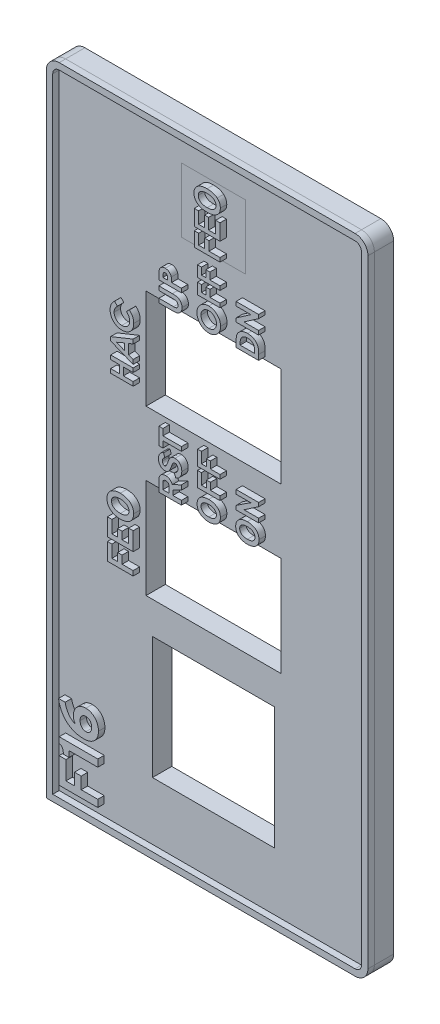
from build123d import *

# Parameters (mm, degrees)
BOSS_EXTRUDE1_DEPTH    = 3
SKETCH2_W              = 21
SKETCH2_H              = 15.5
SKETCH2_W_2            = 19
SKETCH2_H_2            = 19
SKETCH2_W_3            = 10
SKETCH2_H_3            = 10
CUT_EXTRUDE1_DEPTH     = 3
SKETCH5_W              = 10
SKETCH5_H              = 10
BOSS_EXTRUDE6_DEPTH    = 3
BOSS_EXTRUDE8_DEPTH    = 1
BOSS_EXTRUDE8_2_DEPTH  = 1
BOSS_EXTRUDE8_3_DEPTH  = 1
BOSS_EXTRUDE8_4_DEPTH  = 1
BOSS_EXTRUDE8_5_DEPTH  = 1
BOSS_EXTRUDE8_6_DEPTH  = 1
BOSS_EXTRUDE8_7_DEPTH  = 1
BOSS_EXTRUDE8_8_DEPTH  = 1
BOSS_EXTRUDE8_9_DEPTH  = 1
BOSS_EXTRUDE8_10_DEPTH = 1
BOSS_EXTRUDE8_11_DEPTH = 1
BOSS_EXTRUDE8_12_DEPTH = 1
BOSS_EXTRUDE8_13_DEPTH = 1
BOSS_EXTRUDE8_14_DEPTH = 1
BOSS_EXTRUDE8_15_DEPTH = 1
BOSS_EXTRUDE8_16_DEPTH = 1
BOSS_EXTRUDE8_17_DEPTH = 1
BOSS_EXTRUDE8_18_DEPTH = 1
BOSS_EXTRUDE8_19_DEPTH = 1
BOSS_EXTRUDE8_20_DEPTH = 1
BOSS_EXTRUDE8_21_DEPTH = 1
BOSS_EXTRUDE8_22_DEPTH = 1
BOSS_EXTRUDE8_23_DEPTH = 1
BOSS_EXTRUDE8_24_DEPTH = 1
BOSS_EXTRUDE8_25_DEPTH = 1
BOSS_EXTRUDE8_26_DEPTH = 1
BOSS_EXTRUDE8_27_DEPTH = 1
BOSS_EXTRUDE9_DEPTH    = 1


with BuildPart() as part:
    # Sketch1 → Boss-Extrude1 (new body)
    with BuildSketch(Plane(origin=(0, 0, 0), x_dir=(0, 1, 0), z_dir=(0, 0, 1))):
        with BuildLine():
            Line((2, 0), (98, 0))
            ThreePointArc((98, 0), (99.414213562, 0.585786438), (100, 2))
            Line((100, 2), (100, 48))
            ThreePointArc((100, 48), (99.414213562, 49.414213562), (98, 50))
            Line((98, 50), (0, 50))
            Line((0, 50), (0, 2))
            ThreePointArc((0, 2), (0.585786438, 0.585786438), (2, 0))
        make_face()
    extrude(amount=BOSS_EXTRUDE1_DEPTH)

    # Sketch2 → Cut-Extrude1 (cut)
    with BuildSketch(Plane(origin=(0, 0, 0), x_dir=(1, 0, 0), z_dir=(0, 0, -1))):
        with Locations((-25, -67.25)):
            Rectangle(SKETCH2_W, SKETCH2_H)
        with Locations((-25, -19.5)):
            Rectangle(SKETCH2_W_2, SKETCH2_H_2)
        with Locations((-25, -41.75)):
            Rectangle(SKETCH2_W, SKETCH2_H)
        with Locations((-25, -90)):
            Rectangle(SKETCH2_W_3, SKETCH2_H_3)
    extrude(amount=-CUT_EXTRUDE1_DEPTH, mode=Mode.SUBTRACT)


with BuildPart() as body_2:
    # Sketch5 → Boss-Extrude6 (new body)
    with BuildSketch(Plane(origin=(0, 0, 0), x_dir=(1, 0, 0), z_dir=(0, 0, -1))):
        with Locations((-25, -90)):
            Rectangle(SKETCH5_W, SKETCH5_H)
    extrude(amount=-BOSS_EXTRUDE6_DEPTH)


with BuildPart() as body_3:
    # Sketch4 → Boss-Extrude8 (new body)
    with BuildSketch(Plane.XY.offset(3)):
        Polygon((-42, 2.711864407), (-48, 2.711864407), (-48, 6.697809012), (-46.945845391, 6.701529558), (-46.950806118, 3.821827201), (-45.626291856, 3.821827201), (-45.621331129, 5.664737495), (-44.572137247, 5.664737495), (-44.572137247, 3.821827201), (-42, 3.821827201), align=None)
    extrude(amount=BOSS_EXTRUDE8_DEPTH)


with BuildPart() as body_4:
    # Sketch4 → Boss-Extrude8 2 (new body)
    with BuildSketch(Plane.XY.offset(3)):
        with BuildLine():
            Line((-42, 8.138900372), (-46.479536999, 8.138900372))
            Line((-46.479536999, 8.138900372), (-46.479536999, 7.216205043))
            Line((-46.479536999, 7.216205043), (-47.348904506, 7.216205043))
            add(Edge.make_bspline(
                [(-47.348904506, 7.216205043), (-47.349642108, 7.26293338), (-47.351086868, 7.354461445), (-47.361655113, 7.488012147), (-47.382443665, 7.614083963), (-47.407468341, 7.733440512), (-47.442010089, 7.84539985), (-47.486136628, 7.949238837), (-47.542862069, 8.042928234), (-47.609032613, 8.128246341), (-47.686602516, 8.205267708), (-47.778487113, 8.271079202), (-47.883510396, 8.327584788), (-47.960306223, 8.355266331), (-48, 8.369574204)],
                knots=[0, 0, 0, 0, 1.174661471, 2.300841425, 3.363478186, 4.384658415, 5.364115827, 6.304251699, 7.21314311, 8.109050974, 9.012878884, 9.95031164, 10.940569094, 12, 12, 12, 12], degree=3))
            Line((-48, 8.369574204), (-48, 9.248863167))
            Line((-48, 9.248863167), (-42, 9.248863167))
            Line((-42, 9.248863167), (-42, 8.138900372))
        make_face()
    extrude(amount=BOSS_EXTRUDE8_2_DEPTH)


with BuildPart() as body_5:
    # Sketch4 → Boss-Extrude8 3 (new body)
    with BuildSketch(Plane.XY.offset(3)):
        with BuildLine():
            add(Edge.make_bspline(
                [(-41.897064903, 13.042579578), (-41.899196697, 12.956493096), (-41.90334285, 12.789062421), (-41.935825819, 12.545477748), (-41.99039926, 12.317361031), (-42.065597167, 12.10460836), (-42.162077781, 11.908898009), (-42.275183451, 11.728677002), (-42.407120863, 11.565389404), (-42.557201186, 11.420203131), (-42.721286322, 11.290161703), (-42.900968237, 11.179124826), (-43.092756201, 11.08262516), (-43.297857148, 11.005029573), (-43.513366588, 10.944650513), (-43.738150094, 10.901189752), (-43.971659768, 10.87459388), (-44.130561834, 10.87140172), (-44.211244316, 10.869780901)],
                knots=[0, 0, 0, 0, 1.152196076, 2.240920541, 3.282546555, 4.287309629, 5.255055722, 6.197776638, 7.130371717, 8.057895442, 8.987908903, 9.927685005, 10.880552727, 11.857997936, 12.858407828, 13.873225531, 14.920130833, 16, 16, 16, 16], degree=3))
            add(Edge.make_bspline(
                [(-44.211244316, 10.869780901), (-44.28899688, 10.871026433), (-44.443040678, 10.873494086), (-44.671912109, 10.891579629), (-44.896842157, 10.919459189), (-45.117757248, 10.960974222), (-45.335329883, 11.012635493), (-45.54842655, 11.077348187), (-45.757383154, 11.153362729), (-45.96195628, 11.239677665), (-46.160907907, 11.338597258), (-46.351589409, 11.452102461), (-46.535788666, 11.576259702), (-46.712703244, 11.71246916), (-46.879477784, 11.863994889), (-47.042045414, 12.024495779), (-47.193534698, 12.200423374), (-47.339930884, 12.386151822), (-47.474870858, 12.586656453), (-47.600264672, 12.799578142), (-47.713234389, 13.02588838), (-47.813411239, 13.265363223), (-47.904193859, 13.517290971), (-47.983300087, 13.782654369), (-48.050628326, 14.061310748), (-48.085281789, 14.252390614), (-48.102935097, 14.349731294)],
                knots=[0, 0, 0, 0, 0.97554759, 1.932760135, 2.879202054, 3.818266004, 4.751812255, 5.683901811, 6.611027289, 7.540761128, 8.468684383, 9.39656414, 10.323094465, 11.254837541, 12.195232939, 13.148897007, 14.119481001, 15.106272412, 16.114815503, 17.149473338, 18.204986041, 19.285939469, 20.404967402, 21.563618097, 22.758848447, 24, 24, 24, 24], degree=3))
            Line((-48.102935097, 14.349731294), (-47.074824308, 14.349731294))
            add(Edge.make_bspline(
                [(-47.074824308, 14.349731294), (-47.058825495, 14.274675515), (-47.026840416, 14.124622818), (-46.961304298, 13.902125594), (-46.880970138, 13.682156889), (-46.785547279, 13.465379091), (-46.676486426, 13.255179457), (-46.550401038, 13.055922707), (-46.410030019, 12.868349944), (-46.255820633, 12.692703018), (-46.084741122, 12.535352162), (-45.89913342, 12.39726003), (-45.69690401, 12.283077426), (-45.552638568, 12.2265148), (-45.479950393, 12.198015709)],
                knots=[0, 0, 0, 0, 0.986678272, 1.972582758, 2.980054883, 3.996534881, 5.016720443, 6.02267639, 7.025381703, 8.027184541, 9.02427851, 10.00893506, 10.99680149, 12, 12, 12, 12], degree=3))
            add(Edge.make_bspline(
                [(-45.479950393, 12.198015709), (-45.502918809, 12.227328459), (-45.550046897, 12.287474262), (-45.610172486, 12.389046864), (-45.665049857, 12.500802627), (-45.711730463, 12.623699039), (-45.750810946, 12.756577537), (-45.776789265, 12.899188368), (-45.795527917, 13.049940024), (-45.796790078, 13.153306505), (-45.797436957, 13.206283588)],
                knots=[0, 0, 0, 0, 0.828304594, 1.699569116, 2.621562675, 3.59751205, 4.622770721, 5.70035302, 6.821391729, 8, 8, 8, 8], degree=3))
            add(Edge.make_bspline(
                [(-45.797436957, 13.206283588), (-45.794359069, 13.297433599), (-45.788328164, 13.476035614), (-45.740412691, 13.736066562), (-45.660486247, 13.980422088), (-45.549618644, 14.207835659), (-45.411717808, 14.41644534), (-45.250090695, 14.603883587), (-45.063828851, 14.766630548), (-44.856740031, 14.905896992), (-44.629793078, 15.017218843), (-44.386612744, 15.099189544), (-44.127927616, 15.146562193), (-43.950583972, 15.152715826), (-43.86027284, 15.155849525)],
                knots=[0, 0, 0, 0, 1.068158848, 2.092981892, 3.087712766, 4.07401241, 5.049956444, 6.012021349, 6.966781994, 7.94137714, 8.929806188, 9.921462227, 10.941517744, 12, 12, 12, 12], degree=3))
            add(Edge.make_bspline(
                [(-43.86027284, 15.155849525), (-43.812691794, 15.155382518), (-43.718563822, 15.154458653), (-43.579924323, 15.13965251), (-43.445553487, 15.119313811), (-43.315861288, 15.089229228), (-43.190287, 15.050729096), (-43.068691219, 15.003793848), (-42.951529575, 14.947498044), (-42.802027953, 14.862161133), (-42.628373025, 14.735993462), (-42.439956944, 14.561008975), (-42.27933511, 14.356486996), (-42.141596739, 14.130451119), (-42.032868448, 13.882529175), (-41.952215274, 13.617696304), (-41.906610918, 13.335182622), (-41.900293419, 13.14153957), (-41.897064903, 13.042579578)],
                knots=[0, 0, 0, 0, 0.706614415, 1.397871387, 2.069416801, 2.725013738, 3.373958807, 4.019581461, 4.659716846, 5.303496072, 6.575206819, 7.839717575, 9.111724966, 10.426395938, 11.762911402, 13.123140805, 14.529800269, 16, 16, 16, 16], degree=3))
        make_face()
        with BuildLine():
            add(Edge.make_bspline(
                [(-42.942538239, 13.038859033), (-42.944154476, 13.086864345), (-42.947303644, 13.180400617), (-42.966436881, 13.317294706), (-43.003240511, 13.445057457), (-43.05132351, 13.564665531), (-43.111691872, 13.674514102), (-43.185663497, 13.771363192), (-43.268925468, 13.857198408), (-43.364328412, 13.92784868), (-43.468716734, 13.986373158), (-43.585290696, 14.025286349), (-43.710707174, 14.051277957), (-43.798124161, 14.053453442), (-43.842910294, 14.054568003)],
                knots=[0, 0, 0, 0, 1.13300173, 2.207604815, 3.251351599, 4.262078636, 5.244546679, 6.198517067, 7.129674452, 8.056325054, 8.990491857, 9.940614668, 10.944920128, 12, 12, 12, 12], degree=3))
            add(Edge.make_bspline(
                [(-43.842910294, 14.054568003), (-43.876836612, 14.053433518), (-43.942849953, 14.051226052), (-44.039465717, 14.039308614), (-44.130331015, 14.016487709), (-44.216841897, 13.985855554), (-44.297030973, 13.94442454), (-44.372942046, 13.895838094), (-44.442290439, 13.836865915), (-44.506732918, 13.770003913), (-44.564283306, 13.696309204), (-44.614840989, 13.617115752), (-44.65642303, 13.53284555), (-44.691876489, 13.44383305), (-44.718735797, 13.349452899), (-44.738771404, 13.250405651), (-44.749910783, 13.146184846), (-44.75126731, 13.075263374), (-44.751963621, 13.038859033)],
                knots=[0, 0, 0, 0, 1.062504038, 2.067405048, 3.040466198, 3.990269807, 4.933703574, 5.859846532, 6.806028126, 7.776244944, 8.762641005, 9.728445561, 10.712376371, 11.700129936, 12.724101291, 13.779963625, 14.860444365, 16, 16, 16, 16], degree=3))
            add(Edge.make_bspline(
                [(-44.751963621, 13.038859033), (-44.750525592, 12.989997576), (-44.747720832, 12.894697293), (-44.726150107, 12.756212669), (-44.69161944, 12.625750577), (-44.642355032, 12.504244306), (-44.578746372, 12.393754231), (-44.504446167, 12.294633355), (-44.417159828, 12.209561262), (-44.320757072, 12.135938608), (-44.213606496, 12.076914888), (-44.096952492, 12.036439835), (-43.972599171, 12.010637173), (-43.886861312, 12.007431044), (-43.842910294, 12.005787516)],
                knots=[0, 0, 0, 0, 1.13939358, 2.2222942, 3.260922266, 4.281668083, 5.2708592, 6.227503912, 7.16172184, 8.104856155, 9.049960465, 10.001585687, 10.975571055, 12, 12, 12, 12], degree=3))
            add(Edge.make_bspline(
                [(-43.842910294, 12.005787516), (-43.798150662, 12.007489493), (-43.710809051, 12.010810642), (-43.584795236, 12.035611012), (-43.468571169, 12.077958649), (-43.364206602, 12.138740102), (-43.268782444, 12.211916941), (-43.186008025, 12.300128152), (-43.111621505, 12.39824276), (-43.051331932, 12.509377213), (-43.003236002, 12.630199367), (-42.966437022, 12.759201659), (-42.947367865, 12.896912428), (-42.944171538, 12.990855047), (-42.942538239, 13.038859033)],
                knots=[0, 0, 0, 0, 1.048071997, 2.045153049, 2.994980204, 3.931883939, 4.863618441, 5.801972454, 6.756821798, 7.740694641, 8.753129586, 9.798693159, 10.875148447, 12, 12, 12, 12], degree=3))
        make_face(mode=Mode.SUBTRACT)
    extrude(amount=BOSS_EXTRUDE8_3_DEPTH)


with BuildPart() as body_6:
    # Sketch4 → Boss-Extrude8 4 (new body)
    with BuildSketch(Plane.XY.offset(3)):
        Polygon((-36.5, 36.622802572), (-40.5, 36.622802572), (-40.5, 39.280098976), (-39.79723026, 39.28257934), (-39.800537412, 37.362777769), (-38.917527904, 37.362777769), (-38.914220752, 38.591384631), (-38.214758165, 38.591384631), (-38.214758165, 37.362777769), (-36.5, 37.362777769), align=None)
    extrude(amount=BOSS_EXTRUDE8_4_DEPTH)


with BuildPart() as body_7:
    # Sketch4 → Boss-Extrude8 5 (new body)
    with BuildSketch(Plane.XY.offset(3)):
        Polygon((-36.5, 39.903497074), (-40.5, 39.903497074), (-40.5, 42.606266814), (-39.79723026, 42.606266814), (-39.800537412, 40.643472271), (-38.917527904, 40.643472271), (-38.914220752, 41.803455735), (-38.214758165, 41.805936099), (-38.214758165, 40.643472271), (-37.208557255, 40.643472271), (-37.206076891, 42.7236707), (-36.5, 42.726151064), align=None)
    extrude(amount=BOSS_EXTRUDE8_5_DEPTH)


with BuildPart() as body_8:
    # Sketch4 → Boss-Extrude8 6 (new body)
    with BuildSketch(Plane.XY.offset(3)):
        with BuildLine():
            add(Edge.make_bspline(
                [(-36.431376602, 45.040330477), (-36.431677307, 45.001173163), (-36.432268999, 44.92412419), (-36.442163033, 44.810771993), (-36.455634963, 44.701659095), (-36.475524423, 44.597272921), (-36.501103576, 44.497529743), (-36.532874269, 44.402464605), (-36.568585154, 44.311010738), (-36.626144334, 44.197698344), (-36.708095937, 44.065882278), (-36.820697545, 43.920892814), (-36.950679591, 43.794145984), (-37.094619868, 43.684017462), (-37.249780247, 43.58953502), (-37.412811633, 43.507401598), (-37.58423029, 43.438939283), (-37.762878779, 43.38657695), (-37.945399702, 43.344852807), (-38.129780435, 43.316797497), (-38.314654055, 43.29718606), (-38.438215558, 43.295164974), (-38.5, 43.294154371)],
                knots=[0, 0, 0, 0, 0.769389895, 1.513911341, 2.234864908, 2.929682145, 3.601066131, 4.257153215, 4.898928389, 5.528796439, 6.752433833, 7.944488159, 9.128143283, 10.310223118, 11.499430839, 12.693760022, 13.894826845, 15.121924619, 16.349345184, 17.572130951, 18.785992957, 20, 20, 20, 20], degree=3))
            add(Edge.make_bspline(
                [(-38.5, 43.294154371), (-38.561782179, 43.295182638), (-38.685613509, 43.297243615), (-38.870521215, 43.31662579), (-39.055098893, 43.345103722), (-39.237486109, 43.386250204), (-39.416191386, 43.439315288), (-39.587827366, 43.507169006), (-39.751048375, 43.589553343), (-39.906159066, 43.68406011), (-40.050179039, 43.793839007), (-40.179269563, 43.921437875), (-40.292649909, 44.065648505), (-40.37526427, 44.197302969), (-40.430970388, 44.311446498), (-40.468479683, 44.402063835), (-40.498548997, 44.497741218), (-40.524579176, 44.597236771), (-40.544335739, 44.701669318), (-40.557845182, 44.810769126), (-40.567728839, 44.924124945), (-40.568321964, 45.001173417), (-40.568623398, 45.040330477)],
                knots=[0, 0, 0, 0, 1.213848482, 2.432942217, 3.650217747, 4.882761384, 6.104511322, 7.310455229, 8.504628421, 9.69368082, 10.875606264, 12.055245968, 13.250499593, 14.473977167, 15.101359402, 15.745081969, 16.399404203, 17.0707005, 17.765426987, 18.48628639, 19.230710595, 20, 20, 20, 20], degree=3))
            add(Edge.make_bspline(
                [(-40.568623398, 45.040330477), (-40.568318212, 45.079487071), (-40.567717704, 45.156534628), (-40.557911113, 45.269624562), (-40.544257949, 45.378431015), (-40.524569117, 45.482593295), (-40.498677969, 45.581857096), (-40.468488841, 45.676962685), (-40.430786381, 45.766933553), (-40.375285884, 45.880879363), (-40.292913018, 46.012472002), (-40.178977114, 46.155954076), (-40.050224394, 46.283562204), (-39.906115604, 46.393217381), (-39.75128291, 46.487995732), (-39.587573763, 46.569109794), (-39.416363061, 46.637443477), (-39.237440303, 46.689461449), (-39.054993204, 46.729494323), (-38.870585786, 46.758592243), (-38.685558055, 46.776513479), (-38.561772487, 46.778767473), (-38.5, 46.779892279)],
                knots=[0, 0, 0, 0, 0.770269377, 1.51564188, 2.232041099, 2.927652576, 3.599804015, 4.249799295, 4.88932573, 5.517507166, 6.742543289, 7.935072704, 9.116215112, 10.299646173, 11.490213266, 12.683482342, 13.890962462, 15.112717023, 16.34565051, 17.564476688, 18.784605236, 20, 20, 20, 20], degree=3))
            add(Edge.make_bspline(
                [(-38.5, 46.779892279), (-38.438225355, 46.778784611), (-38.314709897, 46.776569881), (-38.129715177, 46.758423525), (-37.945506642, 46.729742597), (-37.762922062, 46.689139488), (-37.584059967, 46.637817482), (-37.413064285, 46.568879155), (-37.249545697, 46.488014046), (-37.09466332, 46.393260106), (-36.950634162, 46.283255083), (-36.820991766, 46.156499212), (-36.707832476, 46.012237068), (-36.626124814, 45.880482582), (-36.568769843, 45.767370818), (-36.532861488, 45.676560017), (-36.500972616, 45.582071027), (-36.475535435, 45.482556516), (-36.455712736, 45.378441327), (-36.44209715, 45.269621655), (-36.432280114, 45.156535396), (-36.431681053, 45.079487329), (-36.431376602, 45.040330477)],
                knots=[0, 0, 0, 0, 1.215554672, 2.430443601, 3.654788187, 4.882587992, 6.109704724, 7.31230268, 8.505728752, 9.696452488, 10.88003925, 12.06520331, 13.254517918, 14.479715217, 15.11038623, 15.74794673, 16.399722364, 17.071962237, 17.767665234, 18.484158709, 19.229629279, 20, 20, 20, 20], degree=3))
        make_face()
        with BuildLine():
            add(Edge.make_bspline(
                [(-37.143241009, 45.040330477), (-37.144393953, 45.083461593), (-37.146630719, 45.16713797), (-37.171817371, 45.287209216), (-37.209726658, 45.3981308), (-37.266806596, 45.497042033), (-37.334676806, 45.586217102), (-37.412682912, 45.666701685), (-37.500277239, 45.737966351), (-37.597880274, 45.798409587), (-37.700905943, 45.852221527), (-37.809405471, 45.897611822), (-37.922538595, 45.9348654), (-38.038945792, 45.964277268), (-38.156485924, 45.985799374), (-38.272479317, 46.003151278), (-38.386864225, 46.012038083), (-38.462506591, 46.013541475), (-38.5, 46.014286657)],
                knots=[0, 0, 0, 0, 1.107148756, 2.14792017, 3.140700486, 4.108308024, 5.069094922, 6.016119684, 6.983260167, 7.964136456, 8.962388206, 9.969053183, 10.984036923, 12.021982741, 13.053086325, 14.055102709, 15.035978998, 16, 16, 16, 16], degree=3))
            add(Edge.make_bspline(
                [(-38.5, 46.014286657), (-38.580339372, 46.011913459), (-38.742180179, 46.007132737), (-38.942465681, 45.974341128), (-39.099510305, 45.936716578), (-39.212679622, 45.900229881), (-39.320322975, 45.855614502), (-39.422143321, 45.802949171), (-39.516525199, 45.741817763), (-39.603176461, 45.672327836), (-39.677943357, 45.591323594), (-39.744680472, 45.50256385), (-39.797950119, 45.402688601), (-39.836216995, 45.291453864), (-39.859640454, 45.16946255), (-39.862103468, 45.084258236), (-39.863373295, 45.040330477)],
                knots=[0, 0, 0, 0, 1.792292384, 3.610509279, 4.516052541, 5.395267581, 6.261127558, 7.11397793, 7.949959357, 8.767475787, 9.585570498, 10.40366521, 11.24018954, 12.099998465, 13.020439153, 14, 14, 14, 14], degree=3))
            add(Edge.make_bspline(
                [(-39.863373295, 45.040330477), (-39.86176032, 44.995860337), (-39.858651036, 44.910136524), (-39.835544301, 44.786784809), (-39.795689577, 44.674999533), (-39.740546427, 44.57446791), (-39.671284664, 44.485889071), (-39.593768429, 44.405306215), (-39.505784722, 44.334145946), (-39.408159022, 44.273456727), (-39.303298303, 44.222416729), (-39.194389888, 44.17715384), (-39.081353369, 44.140103944), (-38.964650578, 44.111243303), (-38.846804672, 44.090672739), (-38.729661196, 44.074364886), (-38.614241221, 44.065292778), (-38.537770554, 44.063802986), (-38.5, 44.063067145)],
                knots=[0, 0, 0, 0, 1.135220881, 2.188332778, 3.190033761, 4.153837244, 5.102543343, 6.053126934, 7.003840769, 7.984051029, 8.981739148, 9.978905898, 10.993722116, 12.016123306, 13.045909338, 14.047165241, 15.035451702, 16, 16, 16, 16], degree=3))
            add(Edge.make_bspline(
                [(-38.5, 44.063067145), (-38.420491874, 44.065507394), (-38.26034744, 44.070422519), (-38.061961874, 44.102378882), (-37.905714257, 44.139524085), (-37.793252081, 44.178210099), (-37.685200048, 44.223478828), (-37.582918731, 44.277030114), (-37.487055541, 44.338412502), (-37.402068883, 44.410708271), (-37.326407264, 44.49124144), (-37.260679738, 44.580170794), (-37.207609264, 44.680203901), (-37.169717476, 44.790865863), (-37.14713663, 44.912367819), (-37.144569672, 44.996686786), (-37.143241009, 45.040330477)],
                knots=[0, 0, 0, 0, 1.778228604, 3.581689399, 4.4834725, 5.368724504, 6.239098721, 7.102367364, 7.948936692, 8.780279036, 9.591670885, 10.416746999, 11.246991015, 12.114740322, 13.024185269, 14, 14, 14, 14], degree=3))
        make_face(mode=Mode.SUBTRACT)
    extrude(amount=BOSS_EXTRUDE8_6_DEPTH)


with BuildPart() as body_9:
    # Sketch4 → Boss-Extrude8 7 (new body)
    with BuildSketch(Plane.XY.offset(3)):
        with BuildLine():
            Line((-29, 49.915254237), (-32.5, 49.915254237))
            Line((-32.5, 49.915254237), (-32.5, 51.50754444))
            add(Edge.make_bspline(
                [(-32.5, 51.50754444), (-32.499670292, 51.543007177), (-32.499025843, 51.612322949), (-32.491500363, 51.713232215), (-32.48019363, 51.808679689), (-32.463871894, 51.898187601), (-32.441835874, 51.981928476), (-32.416174081, 52.059917327), (-32.385692627, 52.132408777), (-32.349955139, 52.198836306), (-32.311049154, 52.260710626), (-32.267922591, 52.316915606), (-32.223108585, 52.369673538), (-32.174684327, 52.417352235), (-32.122954681, 52.460165784), (-32.068460518, 52.498903605), (-32.010636303, 52.53259297), (-31.930262585, 52.57226902), (-31.824770869, 52.611651835), (-31.69336714, 52.645675344), (-31.557069727, 52.666665975), (-31.464591737, 52.668952879), (-31.417734601, 52.670111616)],
                knots=[0, 0, 0, 0, 1.174641422, 2.295964262, 3.350312876, 4.357857736, 5.307350772, 6.216845228, 7.075997957, 7.908743699, 8.71326574, 9.494605711, 10.253695817, 11.005053054, 11.742563745, 12.476256708, 13.217522415, 13.957107197, 15.443851701, 16.937833723, 18.448448748, 20, 20, 20, 20], degree=3))
            add(Edge.make_bspline(
                [(-31.417734601, 52.670111616), (-31.384663398, 52.668969147), (-31.318009148, 52.666666527), (-31.217720663, 52.653114188), (-31.117425647, 52.627395081), (-31.016732176, 52.594773231), (-30.917839994, 52.552709278), (-30.823788887, 52.499098632), (-30.73481472, 52.43615596), (-30.651216242, 52.363679173), (-30.574873727, 52.281345165), (-30.508881241, 52.188319501), (-30.453652756, 52.08495542), (-30.426683264, 52.010718741), (-30.412877222, 51.972715998)],
                knots=[0, 0, 0, 0, 0.911658004, 1.83742574, 2.781966931, 3.761310631, 4.752622314, 5.737676784, 6.738918678, 7.751717246, 8.781725628, 9.825449886, 10.886818876, 12, 12, 12, 12], degree=3))
            Line((-30.412877222, 51.972715998), (-29, 52.662877222))
            Line((-29, 52.662877222), (-29, 51.935097148))
            Line((-29, 51.935097148), (-30.32534105, 51.272426623))
            Line((-30.32534105, 51.272426623), (-30.32534105, 50.562732534))
            Line((-30.32534105, 50.562732534), (-29, 50.562732534))
            Line((-29, 50.562732534), (-29, 49.915254237))
        make_face()
        with BuildLine():
            Line((-30.935200496, 50.562732534), (-30.935200496, 51.517672592))
            add(Edge.make_bspline(
                [(-30.935200496, 51.517672592), (-30.935929669, 51.546430964), (-30.937322854, 51.601377774), (-30.950535647, 51.678868466), (-30.970748944, 51.747725267), (-31.001837165, 51.806172065), (-31.03935169, 51.855822781), (-31.081454188, 51.898638958), (-31.129628991, 51.932809141), (-31.18255403, 51.958562501), (-31.237816751, 51.978921951), (-31.295715221, 51.992309853), (-31.354983138, 52.001519001), (-31.395272296, 52.002570738), (-31.415564283, 52.003100455)],
                knots=[0, 0, 0, 0, 1.331139526, 2.5433244, 3.631648871, 4.641080215, 5.590687886, 6.507052435, 7.412248492, 8.311565467, 9.226907934, 10.134651226, 11.060500801, 12, 12, 12, 12], degree=3))
            add(Edge.make_bspline(
                [(-31.415564283, 52.003100455), (-31.452409702, 52.000832583), (-31.527427796, 51.996215147), (-31.618979196, 51.969246791), (-31.688812498, 51.936588381), (-31.737660649, 51.903399278), (-31.780857151, 51.861704042), (-31.82006553, 51.812695688), (-31.85250135, 51.75415353), (-31.874442371, 51.684375634), (-31.88820217, 51.604548117), (-31.889471957, 51.547638136), (-31.890140554, 51.517672592)],
                knots=[0, 0, 0, 0, 1.432738082, 2.917086675, 3.676489069, 4.425801806, 5.202106704, 6.003453809, 6.859895097, 7.788359584, 8.835476537, 10, 10, 10, 10], degree=3))
            Line((-31.890140554, 51.517672592), (-31.890140554, 50.562732534))
            Line((-31.890140554, 50.562732534), (-30.935200496, 50.562732534))
        make_face(mode=Mode.SUBTRACT)
    extrude(amount=BOSS_EXTRUDE8_7_DEPTH)


with BuildPart() as body_10:
    # Sketch4 → Boss-Extrude8 8 (new body)
    with BuildSketch(Plane.XY.offset(3)):
        with BuildLine():
            add(Edge.make_bspline(
                [(-28.939954527, 54.481603969), (-28.941261196, 54.428227364), (-28.943826669, 54.323429482), (-28.966475998, 54.170135825), (-29.001103137, 54.02381489), (-29.052321145, 53.886070847), (-29.116127009, 53.757019778), (-29.191613207, 53.636694699), (-29.279755124, 53.526111335), (-29.379726156, 53.425480535), (-29.490413276, 53.33584266), (-29.611090327, 53.257681711), (-29.741256449, 53.191397824), (-29.833728008, 53.157957784), (-29.880425796, 53.14107069)],
                knots=[0, 0, 0, 0, 1.093134219, 2.146224042, 3.168502246, 4.169029674, 5.150188791, 6.113935776, 7.073925944, 8.041768404, 9.014894162, 9.986626412, 10.983253943, 12, 12, 12, 12], degree=3))
            Line((-29.880425796, 53.14107069), (-30.097457627, 53.728503514))
            add(Edge.make_bspline(
                [(-30.097457627, 53.728503514), (-30.058545206, 53.7482742), (-29.98194658, 53.787192554), (-29.877862188, 53.861822536), (-29.78377864, 53.945680858), (-29.702193352, 54.040408992), (-29.633908852, 54.14347098), (-29.585229149, 54.255261113), (-29.554800171, 54.373651304), (-29.551491128, 54.454895137), (-29.549813973, 54.496072757)],
                knots=[0, 0, 0, 0, 1.050726561, 2.068342406, 3.076736343, 4.082328737, 5.073845798, 6.044702552, 7.008977151, 8, 8, 8, 8], degree=3))
            add(Edge.make_bspline(
                [(-29.549813973, 54.496072757), (-29.551104449, 54.538609147), (-29.55355648, 54.619432423), (-29.574530288, 54.734118465), (-29.609682802, 54.835291735), (-29.651576531, 54.909072665), (-29.69098009, 54.959938275), (-29.724286211, 54.992272828), (-29.760514459, 55.020089779), (-29.800568415, 55.042440481), (-29.84356844, 55.060017124), (-29.889810358, 55.072046692), (-29.938952328, 55.08056539), (-29.972987326, 55.081074809), (-29.99038859, 55.081335263)],
                knots=[0, 0, 0, 0, 1.850033464, 3.515243492, 5.052088438, 6.490465098, 7.185412325, 7.845907195, 8.504983171, 9.167559131, 9.836010061, 10.520819687, 11.243731191, 12, 12, 12, 12], degree=3))
            add(Edge.make_bspline(
                [(-29.99038859, 55.081335263), (-30.014134052, 55.080305138), (-30.060140535, 55.078309287), (-30.126190702, 55.060412726), (-30.185879067, 55.030187256), (-30.238899606, 54.987922098), (-30.286798824, 54.936393088), (-30.330846553, 54.876732905), (-30.37133338, 54.808927766), (-30.422153526, 54.705594085), (-30.481012385, 54.560935027), (-30.523161142, 54.440086124), (-30.545266639, 54.37670525)],
                knots=[0, 0, 0, 0, 0.740468875, 1.434647595, 2.118330613, 2.815810211, 3.540329847, 4.309978847, 5.12750806, 6.003150562, 7.903797217, 10, 10, 10, 10], degree=3))
            add(Edge.make_bspline(
                [(-30.545266639, 54.37670525), (-30.567720682, 54.311910318), (-30.613007178, 54.181228489), (-30.676625899, 54.020251607), (-30.731190906, 53.892685793), (-30.778779203, 53.801485546), (-30.829946376, 53.713901362), (-30.885478756, 53.630490021), (-30.946306424, 53.552249926), (-31.016855261, 53.48316797), (-31.094547848, 53.421396779), (-31.179883932, 53.367370091), (-31.274800521, 53.323930597), (-31.379450245, 53.293015631), (-31.494286991, 53.27505694), (-31.573932472, 53.272576204), (-31.615233568, 53.271289789)],
                knots=[0, 0, 0, 0, 1.724674897, 3.478415117, 4.352948254, 5.212909237, 6.063860192, 6.903319516, 7.732193661, 8.551401761, 9.380275906, 10.225108734, 11.085518811, 11.997067694, 12.961356014, 14, 14, 14, 14], degree=3))
            add(Edge.make_bspline(
                [(-31.615233568, 53.271289789), (-31.65733825, 53.272894102), (-31.74068407, 53.276069823), (-31.862647649, 53.303458681), (-31.979546388, 53.346069585), (-32.089921275, 53.406648749), (-32.192219721, 53.483411153), (-32.28400466, 53.576674594), (-32.365792814, 53.684568699), (-32.434844738, 53.808337063), (-32.492182787, 53.946316987), (-32.530590125, 54.099421463), (-32.556257082, 54.265637956), (-32.558751892, 54.381181185), (-32.560045473, 54.44109136)],
                knots=[0, 0, 0, 0, 0.899680838, 1.780909704, 2.66056705, 3.553911244, 4.463840704, 5.386662368, 6.344056744, 7.35113339, 8.410588951, 9.530373698, 10.719477152, 12, 12, 12, 12], degree=3))
            add(Edge.make_bspline(
                [(-32.560045473, 54.44109136), (-32.558891783, 54.4906012), (-32.556642415, 54.587131359), (-32.536353996, 54.727354484), (-32.505347128, 54.85942422), (-32.45917437, 54.981811525), (-32.402578993, 55.095071329), (-32.336898083, 55.198814452), (-32.261819305, 55.292400909), (-32.177673348, 55.375051377), (-32.085704935, 55.446570101), (-31.987505058, 55.507310552), (-31.88290627, 55.555498897), (-31.809648305, 55.577943949), (-31.772943365, 55.589189748)],
                knots=[0, 0, 0, 0, 1.186954675, 2.314225293, 3.391702534, 4.434990442, 5.443875633, 6.424335802, 7.374694863, 8.315482062, 9.246940327, 10.163625248, 11.07990857, 12, 12, 12, 12], degree=3))
            Line((-31.772943365, 55.589189748), (-31.580508475, 55.008991319))
            add(Edge.make_bspline(
                [(-31.580508475, 55.008991319), (-31.605959216, 54.996381677), (-31.656558259, 54.971312238), (-31.72622829, 54.921816448), (-31.788957086, 54.862789016), (-31.846458513, 54.795559562), (-31.893698586, 54.716327595), (-31.926656237, 54.624043455), (-31.947180982, 54.519401032), (-31.949151109, 54.445294719), (-31.950186027, 54.406366267)],
                knots=[0, 0, 0, 0, 0.905115402, 1.799475012, 2.713990998, 3.647816683, 4.613641426, 5.638370996, 6.759423364, 8, 8, 8, 8], degree=3))
            add(Edge.make_bspline(
                [(-31.950186027, 54.406366267), (-31.949141063, 54.370127573), (-31.947163999, 54.301564291), (-31.930789605, 54.204728134), (-31.902842037, 54.120510449), (-31.863979777, 54.048851841), (-31.813482735, 53.991636798), (-31.75244289, 53.950745594), (-31.681726427, 53.925561709), (-31.631366178, 53.922998467), (-31.605105415, 53.921661844)],
                knots=[0, 0, 0, 0, 1.296386208, 2.45275103, 3.500756311, 4.458876123, 5.35118499, 6.203316042, 7.063104507, 8, 8, 8, 8], degree=3))
            add(Edge.make_bspline(
                [(-31.605105415, 53.921661844), (-31.586866576, 53.922446899), (-31.551016883, 53.923989978), (-31.500122496, 53.941924775), (-31.453303939, 53.969021778), (-31.411984329, 54.008065553), (-31.374091473, 54.055428737), (-31.338068742, 54.110200229), (-31.302842586, 54.171661099), (-31.260453017, 54.268102053), (-31.206083077, 54.401321296), (-31.166028703, 54.512785541), (-31.144997933, 54.571310459)],
                knots=[0, 0, 0, 0, 0.645694647, 1.269157175, 1.895441879, 2.55682097, 3.275746162, 4.048416437, 4.885186595, 5.790416516, 7.789734949, 10, 10, 10, 10], degree=3))
            add(Edge.make_bspline(
                [(-31.144997933, 54.571310459), (-31.12068612, 54.640709667), (-31.071840854, 54.780140763), (-31.002791834, 54.951616092), (-30.940712817, 55.085526103), (-30.889558642, 55.18197306), (-30.832730501, 55.273368493), (-30.77170746, 55.360264353), (-30.704516585, 55.441395751), (-30.62895036, 55.514131881), (-30.545243097, 55.577817031), (-30.454137419, 55.633732559), (-30.353527676, 55.67900366), (-30.242431493, 55.711731933), (-30.12074458, 55.730209407), (-30.036269276, 55.732626797), (-29.992558909, 55.733877635)],
                knots=[0, 0, 0, 0, 1.740774913, 3.497419645, 4.37343373, 5.234134591, 6.080131326, 6.919650419, 7.746357646, 8.570023684, 9.3967112, 10.231870944, 11.095558062, 12.000540439, 12.965412284, 14, 14, 14, 14], degree=3))
            add(Edge.make_bspline(
                [(-29.992558909, 55.733877635), (-29.965057009, 55.733206546), (-29.911165244, 55.731891502), (-29.831779596, 55.724957379), (-29.755705039, 55.711619486), (-29.682422833, 55.694047126), (-29.612871098, 55.669521681), (-29.545729935, 55.641653994), (-29.482146811, 55.607534011), (-29.402099421, 55.555162344), (-29.309591636, 55.479461641), (-29.211411409, 55.373686462), (-29.128911776, 55.252241139), (-29.06034425, 55.117968614), (-29.005986168, 54.97235149), (-28.968200358, 54.816655536), (-28.944366119, 54.65210501), (-28.941447942, 54.539322108), (-28.939954527, 54.481603969)],
                knots=[0, 0, 0, 0, 0.718216116, 1.407391336, 2.078143244, 2.733257621, 3.372413984, 4.001568262, 4.629713571, 5.253171163, 6.497126099, 7.740236234, 9.00814866, 10.317560232, 11.668340586, 13.056449658, 14.493599266, 16, 16, 16, 16], degree=3))
        make_face()
    extrude(amount=BOSS_EXTRUDE8_8_DEPTH)


with BuildPart() as body_11:
    # Sketch4 → Boss-Extrude8 9 (new body)
    with BuildSketch(Plane.XY.offset(3)):
        Polygon((-29, 57.161947086), (-31.877842084, 57.161947086), (-31.880012402, 56.169388177), (-32.5, 56.169388177), (-32.5, 58.804878049), (-31.877842084, 58.807048367), (-31.880012402, 57.809425382), (-29, 57.809425382), align=None)
    extrude(amount=BOSS_EXTRUDE8_9_DEPTH)


with BuildPart() as body_12:
    # Sketch4 → Boss-Extrude8 10 (new body)
    with BuildSketch(Plane.XY.offset(3)):
        with BuildLine():
            add(Edge.make_bspline(
                [(-22.939954527, 51.307875155), (-22.940217644, 51.273612506), (-22.940735374, 51.206194654), (-22.949392654, 51.107011482), (-22.961180593, 51.011537696), (-22.97858387, 50.920199794), (-23.000965629, 50.832924513), (-23.028764985, 50.749742517), (-23.06001201, 50.669720384), (-23.110376292, 50.570572039), (-23.182083945, 50.455232982), (-23.280610352, 50.3283672), (-23.394344642, 50.217463724), (-23.520292384, 50.121101267), (-23.656057716, 50.03842913), (-23.798710179, 49.966562386), (-23.948701504, 49.906657861), (-24.105018931, 49.860840819), (-24.264724739, 49.824332194), (-24.42605788, 49.799783798), (-24.587822298, 49.78262379), (-24.695938613, 49.78085534), (-24.75, 49.779971062)],
                knots=[0, 0, 0, 0, 0.769389895, 1.513911341, 2.234864908, 2.929682145, 3.601066131, 4.257153215, 4.898928389, 5.528796439, 6.752433833, 7.944488159, 9.128143283, 10.310223118, 11.499430839, 12.693760022, 13.894826845, 15.121924619, 16.349345184, 17.572130951, 18.785992957, 20, 20, 20, 20], degree=3))
            add(Edge.make_bspline(
                [(-24.75, 49.779971062), (-24.804059407, 49.780870796), (-24.91241182, 49.782674151), (-25.074206063, 49.799633554), (-25.235711532, 49.824551745), (-25.395300345, 49.860554916), (-25.551667463, 49.906986865), (-25.701848945, 49.966358868), (-25.844667328, 50.038445163), (-25.980389183, 50.121138585), (-26.106406659, 50.217195119), (-26.219360867, 50.328844129), (-26.31856867, 50.45502843), (-26.390856236, 50.570226086), (-26.43959909, 50.670101674), (-26.472419723, 50.749391844), (-26.498730372, 50.833109554), (-26.521506779, 50.920168163), (-26.538793771, 51.011546642), (-26.550614534, 51.107008973), (-26.559262734, 51.206195315), (-26.559781719, 51.273612728), (-26.560045473, 51.307875155)],
                knots=[0, 0, 0, 0, 1.213848482, 2.432942217, 3.650217747, 4.882761384, 6.104511322, 7.310455229, 8.504628421, 9.69368082, 10.875606264, 12.055245968, 13.250499593, 14.473977167, 15.101359402, 15.745081969, 16.399404203, 17.0707005, 17.765426987, 18.48628639, 19.230710595, 20, 20, 20, 20], degree=3))
            add(Edge.make_bspline(
                [(-26.560045473, 51.307875155), (-26.559778436, 51.342137175), (-26.559252991, 51.409553788), (-26.550672224, 51.50850748), (-26.538725705, 51.603713126), (-26.521497978, 51.694855121), (-26.498843223, 51.781710947), (-26.472427736, 51.864928337), (-26.439438083, 51.943652847), (-26.390875148, 52.043355431), (-26.318798891, 52.15849899), (-26.219104975, 52.284045804), (-26.106446345, 52.395702917), (-25.980351154, 52.491651196), (-25.844872546, 52.574582253), (-25.701627043, 52.645557057), (-25.551817678, 52.705349031), (-25.395260265, 52.750864756), (-25.235619053, 52.785893521), (-25.074262563, 52.8113542), (-24.912363298, 52.827035282), (-24.804050926, 52.829007527), (-24.75, 52.829991732)],
                knots=[0, 0, 0, 0, 0.770269377, 1.51564188, 2.232041099, 2.927652576, 3.599804015, 4.249799295, 4.88932573, 5.517507166, 6.742543289, 7.935072704, 9.116215112, 10.299646173, 11.490213266, 12.683482342, 13.890962462, 15.112717023, 16.34565051, 17.564476688, 18.784605236, 20, 20, 20, 20], degree=3))
            add(Edge.make_bspline(
                [(-24.75, 52.829991732), (-24.695947185, 52.829022522), (-24.58787116, 52.827084634), (-24.42600078, 52.811206572), (-24.264818311, 52.78611076), (-24.105056804, 52.75058304), (-23.948552471, 52.705676285), (-23.79893125, 52.645355248), (-23.655852485, 52.574598278), (-23.520330405, 52.491688581), (-23.394304892, 52.395434186), (-23.280867796, 52.284522799), (-23.181853416, 52.158293422), (-23.110359212, 52.043008247), (-23.060173613, 51.944035454), (-23.028753802, 51.864576003), (-23.000851039, 51.781898136), (-22.978593506, 51.69482294), (-22.961248644, 51.603722149), (-22.949335007, 51.508504936), (-22.9407451, 51.409554459), (-22.940220921, 51.342137401), (-22.939954527, 51.307875155)],
                knots=[0, 0, 0, 0, 1.215554672, 2.430443601, 3.654788187, 4.882587992, 6.109704724, 7.31230268, 8.505728752, 9.696452488, 10.88003925, 12.06520331, 13.254517918, 14.479715217, 15.11038623, 15.74794673, 16.399722364, 17.071962237, 17.767665234, 18.484158709, 19.229629279, 20, 20, 20, 20], degree=3))
        make_face()
        with BuildLine():
            add(Edge.make_bspline(
                [(-23.562835883, 51.307875155), (-23.563844709, 51.345614882), (-23.565801879, 51.418831712), (-23.5878402, 51.523894052), (-23.621010825, 51.620950438), (-23.670955771, 51.707497767), (-23.730342206, 51.785525953), (-23.798597548, 51.855949962), (-23.875242584, 51.918306546), (-23.96064524, 51.971194376), (-24.0507927, 52.018279824), (-24.145729787, 52.057996333), (-24.24472127, 52.090593213), (-24.346577568, 52.116328597), (-24.449425184, 52.135160441), (-24.550919402, 52.150343356), (-24.651006197, 52.158119311), (-24.717193267, 52.159434779), (-24.75, 52.160086813)],
                knots=[0, 0, 0, 0, 1.107148756, 2.14792017, 3.140700486, 4.108308024, 5.069094922, 6.016119684, 6.983260167, 7.964136456, 8.962388206, 9.969053183, 10.984036923, 12.021982741, 13.053086325, 14.055102709, 15.035978998, 16, 16, 16, 16], degree=3))
            add(Edge.make_bspline(
                [(-24.75, 52.160086813), (-24.82029695, 52.158010265), (-24.961907657, 52.153827133), (-25.137157471, 52.125134475), (-25.274571517, 52.092212993), (-25.373594669, 52.060287134), (-25.467782603, 52.021248677), (-25.556875406, 51.975166512), (-25.639459549, 51.921676531), (-25.715279403, 51.860872844), (-25.780700438, 51.789994133), (-25.839095413, 51.712329357), (-25.885706354, 51.624938514), (-25.919189871, 51.527608119), (-25.939685398, 51.420865719), (-25.941840535, 51.346311944), (-25.942951633, 51.307875155)],
                knots=[0, 0, 0, 0, 1.792292384, 3.610509279, 4.516052541, 5.395267581, 6.261127558, 7.11397793, 7.949959357, 8.767475787, 9.585570498, 10.40366521, 11.24018954, 12.099998465, 13.020439153, 14, 14, 14, 14], degree=3))
            add(Edge.make_bspline(
                [(-25.942951633, 51.307875155), (-25.94154028, 51.268963783), (-25.938819656, 51.193955446), (-25.918601263, 51.086022696), (-25.88372838, 50.988210579), (-25.835478124, 50.900245409), (-25.774874081, 50.822738925), (-25.707047375, 50.752228926), (-25.630061631, 50.68996369), (-25.544639145, 50.636860624), (-25.452886015, 50.592200626), (-25.357591152, 50.552595598), (-25.258684198, 50.520176939), (-25.156569256, 50.494923878), (-25.053454088, 50.476924635), (-24.950953546, 50.462655263), (-24.849961068, 50.454717169), (-24.783049235, 50.453413601), (-24.75, 50.45276974)],
                knots=[0, 0, 0, 0, 1.135220881, 2.188332778, 3.190033761, 4.153837244, 5.102543343, 6.053126934, 7.003840769, 7.984051029, 8.981739148, 9.978905898, 10.993722116, 12.016123306, 13.045909338, 14.047165241, 15.035451702, 16, 16, 16, 16], degree=3))
            add(Edge.make_bspline(
                [(-24.75, 50.45276974), (-24.68043039, 50.454904958), (-24.54030401, 50.459205692), (-24.366716639, 50.48716751), (-24.229999975, 50.519669563), (-24.131595571, 50.553519825), (-24.037050042, 50.593129963), (-23.94755389, 50.639987338), (-23.863673599, 50.693696928), (-23.789310272, 50.756955725), (-23.723106356, 50.827422248), (-23.66559477, 50.905235433), (-23.619158106, 50.992764402), (-23.586002792, 51.089593618), (-23.566244551, 51.19590783), (-23.563998463, 51.269686926), (-23.562835883, 51.307875155)],
                knots=[0, 0, 0, 0, 1.778228604, 3.581689399, 4.4834725, 5.368724504, 6.239098721, 7.102367364, 7.948936692, 8.780279036, 9.591670885, 10.416746999, 11.246991015, 12.114740322, 13.024185269, 14, 14, 14, 14], degree=3))
        make_face(mode=Mode.SUBTRACT)
    extrude(amount=BOSS_EXTRUDE8_10_DEPTH)


with BuildPart() as body_13:
    # Sketch4 → Boss-Extrude8 11 (new body)
    with BuildSketch(Plane.XY.offset(3)):
        Polygon((-23, 53.526663911), (-26.5, 53.526663911), (-26.5, 55.851798264), (-25.885076478, 55.853968582), (-25.887970236, 54.174142208), (-25.115336916, 54.174142208), (-25.112443158, 55.249173212), (-24.500413394, 55.249173212), (-24.500413394, 54.174142208), (-23, 54.174142208), align=None)
    extrude(amount=BOSS_EXTRUDE8_11_DEPTH)


with BuildPart() as body_14:
    # Sketch4 → Boss-Extrude8 12 (new body)
    with BuildSketch(Plane.XY.offset(3)):
        Polygon((-23, 56.3972716), (-26.5, 56.3972716), (-26.5, 58.722405953), (-25.885076478, 58.724576271), (-25.887970236, 57.044749897), (-25.115336916, 57.044749897), (-25.112443158, 58.119780901), (-24.500413394, 58.119780901), (-24.500413394, 57.044749897), (-23, 57.044749897), align=None)
    extrude(amount=BOSS_EXTRUDE8_12_DEPTH)


with BuildPart() as body_15:
    # Sketch4 → Boss-Extrude8 13 (new body)
    with BuildSketch(Plane.XY.offset(3)):
        with BuildLine():
            add(Edge.make_bspline(
                [(-16.939954527, 51.307875155), (-16.940217644, 51.273612506), (-16.940735374, 51.206194654), (-16.949392654, 51.107011482), (-16.961180593, 51.011537696), (-16.97858387, 50.920199794), (-17.000965629, 50.832924513), (-17.028764985, 50.749742517), (-17.06001201, 50.669720384), (-17.110376292, 50.570572039), (-17.182083945, 50.455232982), (-17.280610352, 50.3283672), (-17.394344642, 50.217463724), (-17.520292384, 50.121101267), (-17.656057716, 50.03842913), (-17.798710179, 49.966562386), (-17.948701504, 49.906657861), (-18.105018931, 49.860840819), (-18.264724739, 49.824332194), (-18.42605788, 49.799783798), (-18.587822298, 49.78262379), (-18.695938613, 49.78085534), (-18.75, 49.779971062)],
                knots=[0, 0, 0, 0, 0.769389895, 1.513911341, 2.234864908, 2.929682145, 3.601066131, 4.257153215, 4.898928389, 5.528796439, 6.752433833, 7.944488159, 9.128143283, 10.310223118, 11.499430839, 12.693760022, 13.894826845, 15.121924619, 16.349345184, 17.572130951, 18.785992957, 20, 20, 20, 20], degree=3))
            add(Edge.make_bspline(
                [(-18.75, 49.779971062), (-18.804059407, 49.780870796), (-18.91241182, 49.782674151), (-19.074206063, 49.799633554), (-19.235711532, 49.824551745), (-19.395300345, 49.860554916), (-19.551667463, 49.906986865), (-19.701848945, 49.966358868), (-19.844667328, 50.038445163), (-19.980389183, 50.121138585), (-20.106406659, 50.217195119), (-20.219360867, 50.328844129), (-20.31856867, 50.45502843), (-20.390856236, 50.570226086), (-20.43959909, 50.670101674), (-20.472419723, 50.749391844), (-20.498730372, 50.833109554), (-20.521506779, 50.920168163), (-20.538793771, 51.011546642), (-20.550614534, 51.107008973), (-20.559262734, 51.206195315), (-20.559781719, 51.273612728), (-20.560045473, 51.307875155)],
                knots=[0, 0, 0, 0, 1.213848482, 2.432942217, 3.650217747, 4.882761384, 6.104511322, 7.310455229, 8.504628421, 9.69368082, 10.875606264, 12.055245968, 13.250499593, 14.473977167, 15.101359402, 15.745081969, 16.399404203, 17.0707005, 17.765426987, 18.48628639, 19.230710595, 20, 20, 20, 20], degree=3))
            add(Edge.make_bspline(
                [(-20.560045473, 51.307875155), (-20.559778436, 51.342137175), (-20.559252991, 51.409553788), (-20.550672224, 51.50850748), (-20.538725705, 51.603713126), (-20.521497978, 51.694855121), (-20.498843223, 51.781710947), (-20.472427736, 51.864928337), (-20.439438083, 51.943652847), (-20.390875148, 52.043355431), (-20.318798891, 52.15849899), (-20.219104975, 52.284045804), (-20.106446345, 52.395702917), (-19.980351154, 52.491651196), (-19.844872546, 52.574582253), (-19.701627043, 52.645557057), (-19.551817678, 52.705349031), (-19.395260265, 52.750864756), (-19.235619053, 52.785893521), (-19.074262563, 52.8113542), (-18.912363298, 52.827035282), (-18.804050926, 52.829007527), (-18.75, 52.829991732)],
                knots=[0, 0, 0, 0, 0.770269377, 1.51564188, 2.232041099, 2.927652576, 3.599804015, 4.249799295, 4.88932573, 5.517507166, 6.742543289, 7.935072704, 9.116215112, 10.299646173, 11.490213266, 12.683482342, 13.890962462, 15.112717023, 16.34565051, 17.564476688, 18.784605236, 20, 20, 20, 20], degree=3))
            add(Edge.make_bspline(
                [(-18.75, 52.829991732), (-18.695947185, 52.829022522), (-18.58787116, 52.827084634), (-18.42600078, 52.811206572), (-18.264818311, 52.78611076), (-18.105056804, 52.75058304), (-17.948552471, 52.705676285), (-17.79893125, 52.645355248), (-17.655852485, 52.574598278), (-17.520330405, 52.491688581), (-17.394304892, 52.395434186), (-17.280867796, 52.284522799), (-17.181853416, 52.158293422), (-17.110359212, 52.043008247), (-17.060173613, 51.944035454), (-17.028753802, 51.864576003), (-17.000851039, 51.781898136), (-16.978593506, 51.69482294), (-16.961248644, 51.603722149), (-16.949335007, 51.508504936), (-16.9407451, 51.409554459), (-16.940220921, 51.342137401), (-16.939954527, 51.307875155)],
                knots=[0, 0, 0, 0, 1.215554672, 2.430443601, 3.654788187, 4.882587992, 6.109704724, 7.31230268, 8.505728752, 9.696452488, 10.88003925, 12.06520331, 13.254517918, 14.479715217, 15.11038623, 15.74794673, 16.399722364, 17.071962237, 17.767665234, 18.484158709, 19.229629279, 20, 20, 20, 20], degree=3))
        make_face()
        with BuildLine():
            add(Edge.make_bspline(
                [(-17.562835883, 51.307875155), (-17.563844709, 51.345614882), (-17.565801879, 51.418831712), (-17.5878402, 51.523894052), (-17.621010825, 51.620950438), (-17.670955771, 51.707497767), (-17.730342206, 51.785525953), (-17.798597548, 51.855949962), (-17.875242584, 51.918306546), (-17.96064524, 51.971194376), (-18.0507927, 52.018279824), (-18.145729787, 52.057996333), (-18.24472127, 52.090593213), (-18.346577568, 52.116328597), (-18.449425184, 52.135160441), (-18.550919402, 52.150343356), (-18.651006197, 52.158119311), (-18.717193267, 52.159434779), (-18.75, 52.160086813)],
                knots=[0, 0, 0, 0, 1.107148756, 2.14792017, 3.140700486, 4.108308024, 5.069094922, 6.016119684, 6.983260167, 7.964136456, 8.962388206, 9.969053183, 10.984036923, 12.021982741, 13.053086325, 14.055102709, 15.035978998, 16, 16, 16, 16], degree=3))
            add(Edge.make_bspline(
                [(-18.75, 52.160086813), (-18.82029695, 52.158010265), (-18.961907657, 52.153827133), (-19.137157471, 52.125134475), (-19.274571517, 52.092212993), (-19.373594669, 52.060287134), (-19.467782603, 52.021248677), (-19.556875406, 51.975166512), (-19.639459549, 51.921676531), (-19.715279403, 51.860872844), (-19.780700438, 51.789994133), (-19.839095413, 51.712329357), (-19.885706354, 51.624938514), (-19.919189871, 51.527608119), (-19.939685398, 51.420865719), (-19.941840535, 51.346311944), (-19.942951633, 51.307875155)],
                knots=[0, 0, 0, 0, 1.792292384, 3.610509279, 4.516052541, 5.395267581, 6.261127558, 7.11397793, 7.949959357, 8.767475787, 9.585570498, 10.40366521, 11.24018954, 12.099998465, 13.020439153, 14, 14, 14, 14], degree=3))
            add(Edge.make_bspline(
                [(-19.942951633, 51.307875155), (-19.94154028, 51.268963783), (-19.938819656, 51.193955446), (-19.918601263, 51.086022696), (-19.88372838, 50.988210579), (-19.835478124, 50.900245409), (-19.774874081, 50.822738925), (-19.707047375, 50.752228926), (-19.630061631, 50.68996369), (-19.544639145, 50.636860624), (-19.452886015, 50.592200626), (-19.357591152, 50.552595598), (-19.258684198, 50.520176939), (-19.156569256, 50.494923878), (-19.053454088, 50.476924635), (-18.950953546, 50.462655263), (-18.849961068, 50.454717169), (-18.783049235, 50.453413601), (-18.75, 50.45276974)],
                knots=[0, 0, 0, 0, 1.135220881, 2.188332778, 3.190033761, 4.153837244, 5.102543343, 6.053126934, 7.003840769, 7.984051029, 8.981739148, 9.978905898, 10.993722116, 12.016123306, 13.045909338, 14.047165241, 15.035451702, 16, 16, 16, 16], degree=3))
            add(Edge.make_bspline(
                [(-18.75, 50.45276974), (-18.68043039, 50.454904958), (-18.54030401, 50.459205692), (-18.366716639, 50.48716751), (-18.229999975, 50.519669563), (-18.131595571, 50.553519825), (-18.037050042, 50.593129963), (-17.94755389, 50.639987338), (-17.863673599, 50.693696928), (-17.789310272, 50.756955725), (-17.723106356, 50.827422248), (-17.66559477, 50.905235433), (-17.619158106, 50.992764402), (-17.586002792, 51.089593618), (-17.566244551, 51.19590783), (-17.563998463, 51.269686926), (-17.562835883, 51.307875155)],
                knots=[0, 0, 0, 0, 1.778228604, 3.581689399, 4.4834725, 5.368724504, 6.239098721, 7.102367364, 7.948936692, 8.780279036, 9.591670885, 10.416746999, 11.246991015, 12.114740322, 13.024185269, 14, 14, 14, 14], degree=3))
        make_face(mode=Mode.SUBTRACT)
    extrude(amount=BOSS_EXTRUDE8_13_DEPTH)


with BuildPart() as body_16:
    # Sketch4 → Boss-Extrude8 14 (new body)
    with BuildSketch(Plane.XY.offset(3)):
        with BuildLine():
            Line((-17, 53.526663911), (-20.5, 53.526663911))
            Line((-20.5, 53.526663911), (-20.5, 54.131459281))
            Line((-20.5, 54.131459281), (-18.440367921, 55.511781728))
            add(Edge.make_bspline(
                [(-18.440367921, 55.511781728), (-18.422557091, 55.522450858), (-18.382319201, 55.546554353), (-18.317359754, 55.583537432), (-18.248992325, 55.622327063), (-18.201976166, 55.645570492), (-18.179929723, 55.656469616)],
                knots=[0, 0, 0, 0, 0.835953071, 1.888569354, 3.009924726, 4, 4, 4, 4], degree=3))
            add(Edge.make_bspline(
                [(-18.179929723, 55.656469616), (-18.200167326, 55.654077461), (-18.244642414, 55.648820351), (-18.313027336, 55.645698161), (-18.379569984, 55.642410508), (-18.421796178, 55.642125971), (-18.440367921, 55.642000827)],
                knots=[0, 0, 0, 0, 0.93673168, 2.058604719, 3.146143859, 4, 4, 4, 4], degree=3))
            Line((-18.440367921, 55.642000827), (-20.5, 55.642000827))
            Line((-20.5, 55.642000827), (-20.5, 56.286585366))
            Line((-20.5, 56.286585366), (-17, 56.286585366))
            Line((-17, 56.286585366), (-17, 55.709280695))
            Line((-17, 55.709280695), (-19.075547747, 54.301467549))
            add(Edge.make_bspline(
                [(-19.075547747, 54.301467549), (-19.092342144, 54.290715135), (-19.131610099, 54.265574292), (-19.196669125, 54.22908715), (-19.266230127, 54.19118147), (-19.313253109, 54.167747892), (-19.335262505, 54.156779661)],
                knots=[0, 0, 0, 0, 0.804343, 1.880681086, 3.008039723, 4, 4, 4, 4], degree=3))
            add(Edge.make_bspline(
                [(-19.335262505, 54.156779661), (-19.313572808, 54.158893228), (-19.268807061, 54.163255456), (-19.201205854, 54.166272807), (-19.136332078, 54.168554125), (-19.094600103, 54.168913886), (-19.075547747, 54.169078131)],
                knots=[0, 0, 0, 0, 1.005229636, 2.074711121, 3.121026731, 4, 4, 4, 4], degree=3))
            Line((-19.075547747, 54.169078131), (-17, 54.169078131))
            Line((-17, 54.169078131), (-17, 53.526663911))
        make_face()
    extrude(amount=BOSS_EXTRUDE8_14_DEPTH)


with BuildPart() as body_17:
    # Sketch4 → Boss-Extrude8 15 (new body)
    with BuildSketch(Plane.XY.offset(3)):
        with BuildLine():
            Line((-32.5, 75.403846154), (-32.5, 76.032051282))
            Line((-32.5, 76.032051282), (-30.22275641, 76.032051282))
            add(Edge.make_bspline(
                [(-30.22275641, 76.032051282), (-30.199147099, 76.03208683), (-30.153545959, 76.03215549), (-30.088120635, 76.035439863), (-30.027758051, 76.038535344), (-29.972947495, 76.043802206), (-29.923518824, 76.05206365), (-29.879289929, 76.059776871), (-29.840654969, 76.07035184), (-29.796648176, 76.086187903), (-29.747211262, 76.110911577), (-29.695102726, 76.150125508), (-29.64872173, 76.196953583), (-29.609778082, 76.252100799), (-29.576839096, 76.31367075), (-29.555052715, 76.382876805), (-29.540275405, 76.457469177), (-29.539077468, 76.509437737), (-29.538461538, 76.536157853)],
                knots=[0, 0, 0, 0, 1.155195489, 2.231248153, 3.20507519, 4.113220553, 4.92363642, 5.657123012, 6.309133385, 6.880755525, 7.944644177, 8.999147208, 10.058600405, 11.156792429, 12.29246015, 13.460660758, 14.694375292, 16, 16, 16, 16], degree=3))
            add(Edge.make_bspline(
                [(-29.538461538, 76.536157853), (-29.539288988, 76.56451389), (-29.540902375, 76.619803363), (-29.556739513, 76.699328467), (-29.581957661, 76.773008926), (-29.617950383, 76.839284681), (-29.661093973, 76.898089744), (-29.710291173, 76.947867086), (-29.765640158, 76.987150874), (-29.816703689, 77.012755545), (-29.863703528, 77.02712903), (-29.905695044, 77.037911269), (-29.955016645, 77.045740525), (-30.011325768, 77.053070322), (-30.075032685, 77.057225873), (-30.145804377, 77.061958407), (-30.223683904, 77.063655533), (-30.277911754, 77.063949349), (-30.306189904, 77.064102564)],
                knots=[0, 0, 0, 0, 1.26131785, 2.459356261, 3.594833267, 4.716926138, 5.803419038, 6.833631221, 7.818372604, 8.814377287, 9.360705024, 10.004324776, 10.743421339, 11.582437492, 12.532246195, 13.585177397, 14.740744533, 16, 16, 16, 16], degree=3))
            Line((-30.306189904, 77.064102564), (-32.5, 77.064102564))
            Line((-32.5, 77.064102564), (-32.5, 77.692307692))
            Line((-32.5, 77.692307692), (-30.412059295, 77.692307692))
            add(Edge.make_bspline(
                [(-30.412059295, 77.692307692), (-30.369757716, 77.692220455), (-30.288415905, 77.692052705), (-30.171521999, 77.689476577), (-30.064758167, 77.683992467), (-29.968093211, 77.679386447), (-29.881657358, 77.670472219), (-29.805081496, 77.661185689), (-29.738637009, 77.649349197), (-29.662997987, 77.631737245), (-29.575902736, 77.601344007), (-29.475614864, 77.552347172), (-29.377432682, 77.49014487), (-29.28240786, 77.416640375), (-29.194217827, 77.333588687), (-29.116578198, 77.24319226), (-29.051976744, 77.14586577), (-28.999743508, 77.042058774), (-28.959524232, 76.930675853), (-28.931096223, 76.811454308), (-28.913006693, 76.683712353), (-28.911191547, 76.595583182), (-28.91025641, 76.550180288)],
                knots=[0, 0, 0, 0, 1.170930413, 2.251584989, 3.235934929, 4.130173708, 4.929654547, 5.640582214, 6.264911921, 6.796838084, 7.789064304, 8.810388137, 9.880124863, 11.000704429, 12.131026409, 13.227749078, 14.29171941, 15.356377855, 16.43689688, 17.561893293, 18.743922147, 20, 20, 20, 20], degree=3))
            add(Edge.make_bspline(
                [(-28.91025641, 76.550180288), (-28.910766052, 76.520010216), (-28.911771564, 76.460485282), (-28.920591255, 76.372935857), (-28.933695047, 76.288331109), (-28.952441412, 76.20662616), (-28.978031508, 76.128102744), (-29.008272763, 76.052252635), (-29.042874498, 75.978801072), (-29.084867658, 75.910043517), (-29.128976641, 75.844290832), (-29.177238685, 75.783748898), (-29.227513581, 75.727486855), (-29.280952089, 75.676158193), (-29.337173537, 75.629714939), (-29.396232958, 75.588193185), (-29.458144117, 75.551670454), (-29.524017798, 75.519223029), (-29.597203984, 75.491454095), (-29.680303406, 75.468032102), (-29.77440216, 75.447670846), (-29.880120151, 75.432257295), (-29.996976026, 75.418672169), (-30.125415737, 75.409869565), (-30.265023689, 75.405325897), (-30.361808986, 75.404351865), (-30.412059295, 75.403846154)],
                knots=[0, 0, 0, 0, 1.001237316, 1.975420686, 2.917953599, 3.841913885, 4.754568974, 5.656377887, 6.55158913, 7.445656762, 8.327865759, 9.178398172, 10.013362476, 10.830881591, 11.635451955, 12.431789376, 13.224756564, 14.019278107, 14.866442763, 15.819105778, 16.882716987, 18.059987251, 19.363897986, 20.787153213, 22.331910422, 24, 24, 24, 24], degree=3))
            Line((-30.412059295, 75.403846154), (-32.5, 75.403846154))
        make_face()
    extrude(amount=BOSS_EXTRUDE8_15_DEPTH)


with BuildPart() as body_18:
    # Sketch4 → Boss-Extrude8 16 (new body)
    with BuildSketch(Plane.XY.offset(3)):
        with BuildLine():
            Line((-32.5, 78.5), (-32.5, 79.201121795))
            add(Edge.make_bspline(
                [(-32.5, 79.201121795), (-32.499794943, 79.246932184), (-32.499399346, 79.335310026), (-32.494602189, 79.462758142), (-32.486005415, 79.580335284), (-32.475381092, 79.688014371), (-32.460486444, 79.785751357), (-32.443410161, 79.873667891), (-32.422608679, 79.951784617), (-32.397909955, 80.020974702), (-32.368816596, 80.08308972), (-32.337741666, 80.141801494), (-32.300907148, 80.196226373), (-32.260968146, 80.247642098), (-32.217093764, 80.295659734), (-32.169457403, 80.340635102), (-32.117366769, 80.38210508), (-32.061180718, 80.419809678), (-32.002043161, 80.454032351), (-31.939819237, 80.483926592), (-31.874418408, 80.508176396), (-31.806261602, 80.52851861), (-31.735352377, 80.544857769), (-31.661254472, 80.555733611), (-31.584485312, 80.563121036), (-31.532236172, 80.563772874), (-31.505809295, 80.564102564)],
                knots=[0, 0, 0, 0, 1.698787518, 3.27731721, 4.728409951, 6.070286353, 7.288646904, 8.393455548, 9.389990496, 10.283725379, 11.113616976, 11.931887102, 12.744353494, 13.547053751, 14.344590688, 15.153907614, 15.974148981, 16.810666655, 17.660988447, 18.506082349, 19.367288142, 20.244738011, 21.142497992, 22.06302001, 23.020302899, 24, 24, 24, 24], degree=3))
            add(Edge.make_bspline(
                [(-31.505809295, 80.564102564), (-31.476573871, 80.563625543), (-31.41912267, 80.562688138), (-31.334906255, 80.553498553), (-31.254613538, 80.537799831), (-31.177567349, 80.517282449), (-31.105035443, 80.48867232), (-31.035286545, 80.455986932), (-30.970278542, 80.415772253), (-30.909189497, 80.369825252), (-30.851555454, 80.319628498), (-30.798919051, 80.264071345), (-30.751296008, 80.203808172), (-30.706626877, 80.140512576), (-30.668488305, 80.071576426), (-30.63291327, 79.999412937), (-30.602769505, 79.922205399), (-30.586947814, 79.86848302), (-30.578926282, 79.841245994)],
                knots=[0, 0, 0, 0, 1.101964615, 2.165495883, 3.188506962, 4.184641065, 5.166448333, 6.124117473, 7.085225874, 8.042124548, 9.003636759, 9.963451826, 10.9225791, 11.897800977, 12.880319672, 13.889154746, 14.929810112, 16, 16, 16, 16], degree=3))
            add(Edge.make_bspline(
                [(-30.578926282, 79.841245994), (-30.574462228, 79.823303773), (-30.564791651, 79.784435144), (-30.554973587, 79.720118241), (-30.545946482, 79.645999762), (-30.538188777, 79.561840035), (-30.532915346, 79.467590539), (-30.52879703, 79.363342533), (-30.52580259, 79.249048773), (-30.525696334, 79.169573412), (-30.525641026, 79.128205128)],
                knots=[0, 0, 0, 0, 0.618981996, 1.340914327, 2.176866532, 3.120127938, 4.170906482, 5.338178032, 6.614476169, 8, 8, 8, 8], degree=3))
            Line((-30.525641026, 79.128205128), (-29, 79.128205128))
            Line((-29, 79.128205128), (-29, 78.5))
            Line((-29, 78.5), (-32.5, 78.5))
        make_face()
        with BuildLine():
            Line((-31.153846154, 79.128205128), (-31.153846154, 79.350460737))
            add(Edge.make_bspline(
                [(-31.153846154, 79.350460737), (-31.154102552, 79.390903702), (-31.154574328, 79.465319359), (-31.16139806, 79.566944199), (-31.171817258, 79.648613823), (-31.186766075, 79.713129191), (-31.209437711, 79.764084906), (-31.235710422, 79.80798118), (-31.268882666, 79.845944883), (-31.307426222, 79.878118813), (-31.350844815, 79.904262979), (-31.39902211, 79.922640673), (-31.451271104, 79.934229639), (-31.487750451, 79.935331031), (-31.506510417, 79.935897436)],
                knots=[0, 0, 0, 0, 1.862197296, 3.426470689, 4.686743892, 5.65255712, 6.462325617, 7.244961981, 8.000258385, 8.771939908, 9.549006364, 10.32248703, 11.137317743, 12, 12, 12, 12], degree=3))
            add(Edge.make_bspline(
                [(-31.506510417, 79.935897436), (-31.5229051, 79.935348916), (-31.554714727, 79.934284655), (-31.60059162, 79.926358557), (-31.643274469, 79.914056849), (-31.682168289, 79.895256074), (-31.718180241, 79.87243022), (-31.750189266, 79.843472786), (-31.779230963, 79.810078912), (-31.794583834, 79.784254056), (-31.802383814, 79.771133814)],
                knots=[0, 0, 0, 0, 1.102449765, 2.139017612, 3.12397484, 4.080535277, 5.035673127, 5.982361139, 6.974944601, 8, 8, 8, 8], degree=3))
            add(Edge.make_bspline(
                [(-31.802383814, 79.771133814), (-31.808002861, 79.760023021), (-31.819899535, 79.736499194), (-31.833730288, 79.696435836), (-31.845398051, 79.650203334), (-31.855082183, 79.597489564), (-31.862598074, 79.538504818), (-31.868345851, 79.47325962), (-31.870657256, 79.401657954), (-31.871405207, 79.35186328), (-31.871794872, 79.325921474)],
                knots=[0, 0, 0, 0, 0.656809284, 1.390599849, 2.23162475, 3.173112763, 4.218524733, 5.370385145, 6.63003504, 8, 8, 8, 8], degree=3))
            Line((-31.871794872, 79.325921474), (-31.871794872, 79.128205128))
            Line((-31.871794872, 79.128205128), (-31.153846154, 79.128205128))
        make_face(mode=Mode.SUBTRACT)
    extrude(amount=BOSS_EXTRUDE8_16_DEPTH)


with BuildPart() as body_19:
    # Sketch4 → Boss-Extrude8 17 (new body)
    with BuildSketch(Plane.XY.offset(3)):
        with BuildLine():
            add(Edge.make_bspline(
                [(-26.58974359, 77.048677885), (-26.588167721, 77.109529486), (-26.5850566, 77.229664329), (-26.559132442, 77.406342595), (-26.516869189, 77.576592097), (-26.458203575, 77.74039596), (-26.381234536, 77.897009984), (-26.289491395, 78.047960571), (-26.178986383, 78.191335847), (-26.053655216, 78.326640476), (-25.917274317, 78.451646668), (-25.770441097, 78.559936969), (-25.616840026, 78.65253605), (-25.455888991, 78.728716091), (-25.287039251, 78.787232701), (-25.110994412, 78.828116594), (-24.927706796, 78.854416011), (-24.802909074, 78.857438328), (-24.739483173, 78.858974359)],
                knots=[0, 0, 0, 0, 1.014235534, 2.002330665, 2.970116157, 3.9352621, 4.897279957, 5.875024536, 6.875755618, 7.909865842, 8.947091691, 9.955591861, 10.946663836, 11.933282567, 12.91916997, 13.920121047, 14.942943865, 16, 16, 16, 16], degree=3))
            add(Edge.make_bspline(
                [(-24.739483173, 78.858974359), (-24.676772131, 78.857338021), (-24.55319801, 78.854113565), (-24.371596661, 78.829195338), (-24.197447913, 78.787596816), (-24.030397792, 78.730232015), (-23.871288648, 78.655300547), (-23.719456335, 78.564285752), (-23.575421581, 78.456228857), (-23.439791309, 78.333718914), (-23.31584061, 78.199681146), (-23.20732277, 78.056919768), (-23.11539022, 77.907136148), (-23.039684465, 77.750447595), (-22.98257561, 77.585725006), (-22.939870401, 77.414827763), (-22.915166628, 77.236365893), (-22.91190961, 77.115125197), (-22.91025641, 77.053585737)],
                knots=[0, 0, 0, 0, 1.051628416, 2.072267533, 3.067761847, 4.050852917, 5.029392597, 6.012272624, 7.015026456, 8.044749159, 9.073964344, 10.072810436, 11.047668484, 12.017263184, 12.98554948, 13.966731695, 14.967951888, 16, 16, 16, 16], degree=3))
            add(Edge.make_bspline(
                [(-22.91025641, 77.053585737), (-22.91172221, 76.989217992), (-22.914602305, 76.86274417), (-22.941759654, 76.67760322), (-22.983164649, 76.500474999), (-23.043109119, 76.331844841), (-23.120998612, 76.171843839), (-23.215044231, 76.019754454), (-23.327062596, 75.876720536), (-23.453675043, 75.743218856), (-23.592252759, 75.622280101), (-23.738638503, 75.515524245), (-23.891725246, 75.425474236), (-24.051581713, 75.35212545), (-24.217215196, 75.294300274), (-24.38963425, 75.253511167), (-24.568425406, 75.229416072), (-24.689863931, 75.226059765), (-24.751402244, 75.224358974)],
                knots=[0, 0, 0, 0, 1.067953136, 2.098381936, 3.099641766, 4.083805132, 5.062469929, 6.048665414, 7.046702845, 8.073106546, 9.098695993, 10.09591865, 11.076726721, 12.041940862, 13.011263376, 13.984305721, 14.978557872, 16, 16, 16, 16], degree=3))
            add(Edge.make_bspline(
                [(-24.751402244, 75.224358974), (-24.792801939, 75.224892936), (-24.875077116, 75.2259541), (-24.997005781, 75.238730896), (-25.116550437, 75.25713764), (-25.233253879, 75.284316301), (-25.348077566, 75.317547259), (-25.459998546, 75.360038738), (-25.56977582, 75.40902863), (-25.676179008, 75.465670253), (-25.777982507, 75.52970385), (-25.876061507, 75.598085157), (-25.967849216, 75.673417937), (-26.054324601, 75.754162625), (-26.135156419, 75.840589121), (-26.210260646, 75.932871657), (-26.280496839, 76.030347388), (-26.344932582, 76.133025278), (-26.401890013, 76.240145878), (-26.452895691, 76.349345388), (-26.494766818, 76.461077594), (-26.529240778, 76.5746877), (-26.556944788, 76.69001514), (-26.575356866, 76.807976558), (-26.588128579, 76.927569361), (-26.589203975, 77.008212572), (-26.58974359, 77.048677885)],
                knots=[0, 0, 0, 0, 1.034634222, 2.056167603, 3.061938024, 4.056975325, 5.049831446, 6.048294015, 7.047371884, 8.053753139, 9.058980286, 10.052730068, 11.041053953, 12.024946181, 13.008838409, 13.997162294, 14.997691456, 16.01096975, 17.025258359, 18.029177048, 19.022170708, 20.005507574, 20.996177714, 21.984639769, 22.988728483, 24, 24, 24, 24], degree=3))
        make_face()
        with BuildLine():
            add(Edge.make_bspline(
                [(-25.961538462, 77.038862179), (-25.960439594, 76.997908933), (-25.958270869, 76.917083613), (-25.941748119, 76.798527588), (-25.91535941, 76.684709617), (-25.877135687, 76.576260639), (-25.828486588, 76.472710625), (-25.7695821, 76.373876014), (-25.698397447, 76.281125461), (-25.618754215, 76.193222227), (-25.530013352, 76.113816119), (-25.434912425, 76.043658318), (-25.333610251, 75.984947539), (-25.227047904, 75.935776894), (-25.114027118, 75.898762295), (-24.995433197, 75.872397907), (-24.871061798, 75.855736597), (-24.786277978, 75.853636419), (-24.742988782, 75.852564103)],
                knots=[0, 0, 0, 0, 1.033739768, 2.040188636, 3.016340934, 3.979330865, 4.937572243, 5.900995986, 6.878200029, 7.884839167, 8.891893314, 9.879764717, 10.863503415, 11.843163062, 12.837761627, 13.859916423, 14.907309254, 16, 16, 16, 16], degree=3))
            add(Edge.make_bspline(
                [(-24.742988782, 75.852564103), (-24.695016002, 75.853989092), (-24.600997301, 75.856781835), (-24.463821902, 75.876341064), (-24.334150974, 75.910103304), (-24.212628361, 75.957982585), (-24.098569642, 76.018664879), (-23.992617566, 76.092992184), (-23.89427387, 76.180952491), (-23.836841652, 76.248678828), (-23.807692308, 76.283052885)],
                knots=[0, 0, 0, 0, 1.078420897, 2.113526272, 3.107597235, 4.084297302, 5.043369457, 6.005430726, 6.9876695, 8, 8, 8, 8], degree=3))
            add(Edge.make_bspline(
                [(-23.807692308, 76.283052885), (-23.786158968, 76.311214163), (-23.743577439, 76.366902242), (-23.689000474, 76.45579254), (-23.642222571, 76.547332043), (-23.604426578, 76.642211532), (-23.574696886, 76.740230627), (-23.553877671, 76.841375886), (-23.540811814, 76.945503994), (-23.539250196, 77.015920301), (-23.538461538, 77.051482372)],
                knots=[0, 0, 0, 0, 1.023928204, 2.024787132, 3.009472467, 3.9914905, 4.972207045, 5.96565515, 6.972602802, 8, 8, 8, 8], degree=3))
            add(Edge.make_bspline(
                [(-23.538461538, 77.051482372), (-23.539571354, 77.091730602), (-23.541754951, 77.17092026), (-23.558051007, 77.287281071), (-23.585754907, 77.398703687), (-23.623360596, 77.506234469), (-23.673815369, 77.608382987), (-23.733422698, 77.706774236), (-23.805069551, 77.799692947), (-23.886390935, 77.887105203), (-23.975443642, 77.967282486), (-24.070575808, 78.038013993), (-24.170902252, 78.097690568), (-24.276406378, 78.14648627), (-24.386972237, 78.184709444), (-24.50293853, 78.210807067), (-24.623776907, 78.227595384), (-24.706006023, 78.229698052), (-24.747896635, 78.230769231)],
                knots=[0, 0, 0, 0, 1.026460056, 2.019592442, 2.989754624, 3.951362471, 4.919177453, 5.890456226, 6.881277895, 7.906300149, 8.932084862, 9.933608786, 10.925308803, 11.904168404, 12.893913482, 13.903284022, 14.931853825, 16, 16, 16, 16], degree=3))
            add(Edge.make_bspline(
                [(-24.747896635, 78.230769231), (-24.789547888, 78.229664797), (-24.871532028, 78.227490887), (-24.992037961, 78.211102686), (-25.107356876, 78.18385786), (-25.217786038, 78.145352212), (-25.32390519, 78.097382187), (-25.42479331, 78.03712385), (-25.520363111, 77.96588333), (-25.610046419, 77.884962964), (-25.692465159, 77.796900607), (-25.763988235, 77.702353049), (-25.826139881, 77.603970359), (-25.874826882, 77.499493975), (-25.913615736, 77.391061703), (-25.942180398, 77.278011802), (-25.958154796, 77.159916111), (-25.960400519, 77.079573169), (-25.961538462, 77.038862179)],
                knots=[0, 0, 0, 0, 1.055040155, 2.076685641, 3.074845078, 4.052329834, 5.035358467, 6.020382375, 7.023447318, 8.050688466, 9.077178457, 10.074336316, 11.0503314, 12.019748348, 12.988025369, 13.964577102, 14.968620271, 16, 16, 16, 16], degree=3))
        make_face(mode=Mode.SUBTRACT)
    extrude(amount=BOSS_EXTRUDE8_17_DEPTH)


with BuildPart() as body_20:
    # Sketch4 → Boss-Extrude8 18 (new body)
    with BuildSketch(Plane.XY.offset(3)):
        Polygon((-26.5, 79.487179487), (-26.5, 81.192307692), (-25.871794872, 81.192307692), (-25.871794872, 80.115384615), (-25.198717949, 80.115384615), (-25.198717949, 81.192307692), (-24.570512821, 81.192307692), (-24.570512821, 80.115384615), (-23, 80.115384615), (-23, 79.487179487), align=None)
    extrude(amount=BOSS_EXTRUDE8_18_DEPTH)


with BuildPart() as body_21:
    # Sketch4 → Boss-Extrude8 19 (new body)
    with BuildSketch(Plane.XY.offset(3)):
        Polygon((-26.5, 81.820512821), (-26.5, 83.525641026), (-25.871794872, 83.525641026), (-25.871794872, 82.448717949), (-25.198717949, 82.448717949), (-25.198717949, 83.525641026), (-24.570512821, 83.525641026), (-24.570512821, 82.448717949), (-23, 82.448717949), (-23, 81.820512821), align=None)
    extrude(amount=BOSS_EXTRUDE8_19_DEPTH)


with BuildPart() as body_22:
    # Sketch4 → Boss-Extrude8 20 (new body)
    with BuildSketch(Plane.XY.offset(3)):
        with BuildLine():
            Line((-20.5, 75.403846154), (-20.5, 76.19541266))
            add(Edge.make_bspline(
                [(-20.5, 76.19541266), (-20.499578594, 76.257125887), (-20.498764011, 76.376418251), (-20.489233964, 76.549224697), (-20.475241045, 76.71003343), (-20.453820297, 76.858478156), (-20.428974202, 76.995101849), (-20.395644783, 77.11886817), (-20.357640591, 77.230674568), (-20.312804681, 77.331606919), (-20.260558183, 77.423752611), (-20.202352997, 77.511246794), (-20.136064826, 77.593919116), (-20.062970397, 77.672929366), (-19.981733047, 77.747258004), (-19.893698202, 77.818142839), (-19.797589281, 77.883848297), (-19.695710659, 77.94636051), (-19.587630589, 78.002894489), (-19.474269024, 78.052205537), (-19.356355489, 78.093513701), (-19.233764318, 78.127078724), (-19.106902477, 78.153833921), (-18.97551397, 78.172553993), (-18.839720442, 78.184126928), (-18.7476865, 78.185300905), (-18.700921474, 78.185897436)],
                knots=[0, 0, 0, 0, 1.443572968, 2.79044287, 4.047742841, 5.218390556, 6.298195001, 7.294187071, 8.214052338, 9.058415274, 9.873579163, 10.689402867, 11.514245497, 12.34988967, 13.204999844, 14.087904451, 14.991805053, 15.926675376, 16.882870032, 17.842731001, 18.816259901, 19.80313118, 20.814314197, 21.847329874, 22.906167961, 24, 24, 24, 24], degree=3))
            add(Edge.make_bspline(
                [(-18.700921474, 78.185897436), (-18.634932979, 78.184335396), (-18.505030763, 78.181260429), (-18.314400757, 78.155358626), (-18.131662884, 78.113466639), (-17.958246589, 78.054562701), (-17.795696172, 77.981537585), (-17.646878133, 77.894300909), (-17.512591281, 77.79413176), (-17.393504152, 77.682197127), (-17.29114743, 77.560999151), (-17.203485402, 77.43505012), (-17.134360039, 77.303122583), (-17.090513664, 77.186877138), (-17.063270001, 77.086075056), (-17.047083391, 76.997581235), (-17.032639367, 76.896993283), (-17.019738179, 76.783644217), (-17.011139953, 76.65754519), (-17.005119024, 76.51867486), (-17.000668347, 76.367215435), (-17.00022862, 76.262022757), (-17, 76.207331731)],
                knots=[0, 0, 0, 0, 1.315448733, 2.589537832, 3.828572084, 5.048874227, 6.235690825, 7.376293813, 8.481764604, 9.569767924, 10.627792487, 11.639989165, 12.623927547, 13.589954798, 14.111118089, 14.704320463, 15.382530461, 16.137544902, 16.978618851, 17.902349489, 18.90940453, 20, 20, 20, 20], degree=3))
            Line((-17, 76.207331731), (-17, 75.403846154))
            Line((-17, 75.403846154), (-20.5, 75.403846154))
        make_face()
        with BuildLine():
            Line((-19.871794872, 76.032051282), (-17.628205128, 76.032051282))
            Line((-17.628205128, 76.032051282), (-17.628205128, 76.360176282))
            add(Edge.make_bspline(
                [(-17.628205128, 76.360176282), (-17.628394152, 76.399211349), (-17.628757652, 76.474277408), (-17.633752105, 76.582788217), (-17.641862503, 76.682928935), (-17.653859003, 76.774830733), (-17.668293863, 76.858704886), (-17.686147882, 76.934245445), (-17.707859729, 77.001601298), (-17.733447361, 77.061327891), (-17.762661318, 77.115856951), (-17.796774213, 77.166373717), (-17.834684458, 77.21512855), (-17.877472703, 77.261220367), (-17.924581701, 77.304820745), (-17.976251594, 77.345672508), (-18.032325449, 77.384320699), (-18.093099544, 77.419773352), (-18.157932147, 77.452170174), (-18.226195242, 77.480909786), (-18.29845732, 77.504739164), (-18.374041919, 77.524544685), (-18.45360709, 77.538697976), (-18.536563503, 77.550407124), (-18.623239826, 77.556443531), (-18.682217292, 77.55727199), (-18.712139423, 77.557692308)],
                knots=[0, 0, 0, 0, 1.502695833, 2.889746668, 4.180916226, 5.369476429, 6.456726991, 7.456222963, 8.355346258, 9.177624335, 9.954596642, 10.733182277, 11.52153258, 12.330160087, 13.151502329, 13.990398686, 14.863901178, 15.771270193, 16.696748626, 17.652564526, 18.61995629, 19.623816541, 20.657945923, 21.72937045, 22.847999446, 24, 24, 24, 24], degree=3))
            add(Edge.make_bspline(
                [(-18.712139423, 77.557692308), (-18.757993301, 77.55685818), (-18.847404811, 77.555231695), (-18.977617239, 77.53944818), (-19.100078276, 77.514016331), (-19.214473331, 77.476969156), (-19.321529664, 77.431410819), (-19.419867721, 77.373482441), (-19.511099367, 77.306703177), (-19.564608967, 77.253865426), (-19.591346154, 77.227463942)],
                knots=[0, 0, 0, 0, 1.138242922, 2.219485503, 3.251901297, 4.239342788, 5.201071, 6.134757343, 7.067992642, 8, 8, 8, 8], degree=3))
            add(Edge.make_bspline(
                [(-19.591346154, 77.227463942), (-19.614130624, 77.201431748), (-19.660665325, 77.148263939), (-19.716425797, 77.054918739), (-19.765416837, 76.952057162), (-19.804261268, 76.837326045), (-19.834981101, 76.711834213), (-19.856167818, 76.574834233), (-19.869782177, 76.427059771), (-19.8711096, 76.324685067), (-19.871794872, 76.271834936)],
                knots=[0, 0, 0, 0, 0.813307809, 1.661089106, 2.549956539, 3.493439533, 4.508053171, 5.589449661, 6.755572447, 8, 8, 8, 8], degree=3))
            Line((-19.871794872, 76.271834936), (-19.871794872, 76.032051282))
        make_face(mode=Mode.SUBTRACT)
    extrude(amount=BOSS_EXTRUDE8_20_DEPTH)


with BuildPart() as body_23:
    # Sketch4 → Boss-Extrude8 21 (new body)
    with BuildSketch(Plane.XY.offset(3)):
        Polygon((-20.5, 78.814102564), (-20.5, 79.379907853), (-18.196814904, 80.967948718), (-20.5, 80.967948718), (-20.5, 81.596153846), (-17, 81.596153846), (-17, 81.026141827), (-19.296173878, 79.442307692), (-17, 79.442307692), (-17, 78.814102564), align=None)
    extrude(amount=BOSS_EXTRUDE8_21_DEPTH)


with BuildPart() as body_24:
    # Sketch4 → Boss-Extrude8 22 (new body)
    with BuildSketch(Plane.XY.offset(3)):
        Polygon((-40, 62.179487179), (-40, 62.807692308), (-38.653846154, 62.807692308), (-38.653846154, 64.019230769), (-40, 64.019230769), (-40, 64.647435897), (-36.5, 64.647435897), (-36.5, 64.019230769), (-38.025641026, 64.019230769), (-38.025641026, 62.807692308), (-36.5, 62.807692308), (-36.5, 62.179487179), align=None)
    extrude(amount=BOSS_EXTRUDE8_22_DEPTH)


with BuildPart() as body_25:
    # Sketch4 → Boss-Extrude8 23 (new body)
    with BuildSketch(Plane.XY.offset(3)):
        Polygon((-40, 66.53135016), (-40, 67.115384615), (-36.5, 68.528846154), (-36.5, 67.857872596), (-37.217948718, 67.58583734), (-37.217948718, 66.062299679), (-36.5, 65.789563301), (-36.5, 65.118589744), align=None)
        Polygon((-39.061197917, 66.823717949), (-37.846153846, 66.30068109), (-37.846153846, 67.347455929), align=None, mode=Mode.SUBTRACT)
    extrude(amount=BOSS_EXTRUDE8_23_DEPTH)


with BuildPart() as body_26:
    # Sketch4 → Boss-Extrude8 24 (new body)
    with BuildSketch(Plane.XY.offset(3)):
        with BuildLine():
            Line((-39.392828526, 72.185897436), (-38.952524038, 71.725260417))
            add(Edge.make_bspline(
                [(-38.952524038, 71.725260417), (-38.992934639, 71.686189071), (-39.071869203, 71.609870493), (-39.176255991, 71.4868304), (-39.263613819, 71.359200079), (-39.335710047, 71.228253097), (-39.392455963, 71.093733172), (-39.432581555, 70.955189155), (-39.457317283, 70.812823484), (-39.460125835, 70.716444693), (-39.461538462, 70.66796875)],
                knots=[0, 0, 0, 0, 1.115315123, 2.178559852, 3.196385012, 4.180486591, 5.141138664, 6.08807191, 7.038351522, 8, 8, 8, 8], degree=3))
            add(Edge.make_bspline(
                [(-39.461538462, 70.66796875), (-39.460419139, 70.627486979), (-39.458210278, 70.547600663), (-39.441978129, 70.4303177), (-39.41447877, 70.31808795), (-39.376254862, 70.210822369), (-39.328118145, 70.107990628), (-39.267613762, 70.01055027), (-39.196761119, 69.917977643), (-39.115684202, 69.831354379), (-39.026446239, 69.75315231), (-38.932462667, 69.682691135), (-38.832071144, 69.624328633), (-38.726735686, 69.576687388), (-38.616418257, 69.539144992), (-38.501124378, 69.512499647), (-38.380593736, 69.497061317), (-38.29865493, 69.494759563), (-38.257011218, 69.493589744)],
                knots=[0, 0, 0, 0, 1.035268443, 2.04298821, 3.02163646, 3.985902049, 4.951223231, 5.920091634, 6.913651787, 7.92868536, 8.949353712, 9.945284791, 10.92850487, 11.913014323, 12.897904816, 13.904240668, 14.934873455, 16, 16, 16, 16], degree=3))
            add(Edge.make_bspline(
                [(-38.257011218, 69.493589744), (-38.227783753, 69.493932115), (-38.170175819, 69.494606936), (-38.085174089, 69.501792464), (-38.002533841, 69.513758758), (-37.922453692, 69.530427888), (-37.844829077, 69.551796331), (-37.769478232, 69.576480565), (-37.697299563, 69.608008633), (-37.626941617, 69.642689092), (-37.560098057, 69.682587872), (-37.496724872, 69.726277158), (-37.436807878, 69.77335431), (-37.380560119, 69.824448049), (-37.32879132, 69.880201757), (-37.280091888, 69.939268896), (-37.235230004, 70.002236252), (-37.194920063, 70.069129064), (-37.157346925, 70.13792308), (-37.126232752, 70.21003554), (-37.098262614, 70.283449323), (-37.077220736, 70.3594529), (-37.058918726, 70.436707323), (-37.047741124, 70.516287945), (-37.039247624, 70.597439502), (-37.038724695, 70.652286749), (-37.038461538, 70.679887821)],
                knots=[0, 0, 0, 0, 1.103738238, 2.175490744, 3.219137561, 4.256155604, 5.262629953, 6.259184223, 7.247888397, 8.234817694, 9.220364322, 10.185094651, 11.140491148, 12.096499151, 13.05201798, 14.011605636, 14.986460005, 15.968997565, 16.960259839, 17.944382265, 18.933125845, 19.924977513, 20.920749559, 21.929466621, 22.958034467, 24, 24, 24, 24], degree=3))
            add(Edge.make_bspline(
                [(-37.038461538, 70.679887821), (-37.039810589, 70.726705517), (-37.042461123, 70.818690116), (-37.063339262, 70.953658547), (-37.097317055, 71.082477362), (-37.138600398, 71.185031145), (-37.178630453, 71.265425318), (-37.214615685, 71.32714151), (-37.256100927, 71.390283797), (-37.303258443, 71.454756018), (-37.355882178, 71.520932382), (-37.415000382, 71.587717759), (-37.478702182, 71.656800467), (-37.524165881, 71.702056705), (-37.547475962, 71.725260417)],
                knots=[0, 0, 0, 0, 1.404693586, 2.759857621, 4.088769373, 5.395275838, 6.0697462, 6.783214465, 7.53810233, 8.336454657, 9.18000028, 10.074808326, 11.012918585, 12, 12, 12, 12], degree=3))
            Line((-37.547475962, 71.725260417), (-37.078425481, 72.171875))
            add(Edge.make_bspline(
                [(-37.078425481, 72.171875), (-37.048114979, 72.140480399), (-36.988955361, 72.079204851), (-36.904954225, 71.986772388), (-36.829469865, 71.894456256), (-36.759762532, 71.804486618), (-36.697862968, 71.71538968), (-36.643709355, 71.627174888), (-36.595932068, 71.540840875), (-36.555336849, 71.454594885), (-36.520867291, 71.367900252), (-36.491191265, 71.278701663), (-36.466086414, 71.186726429), (-36.445830096, 71.091412808), (-36.429587264, 70.993649826), (-36.418623446, 70.892522553), (-36.411252837, 70.788672184), (-36.410590526, 70.71822887), (-36.41025641, 70.682692308)],
                knots=[0, 0, 0, 0, 1.244526981, 2.429050516, 3.560637417, 4.644440555, 5.67424972, 6.652764056, 7.595344123, 8.486817594, 9.369275933, 10.254498637, 11.166417451, 12.086725134, 13.032340136, 13.991389299, 14.986715468, 16, 16, 16, 16], degree=3))
            add(Edge.make_bspline(
                [(-36.41025641, 70.682692308), (-36.411920432, 70.617416044), (-36.415176461, 70.48968854), (-36.43930143, 70.302507213), (-36.479746515, 70.124689977), (-36.536947022, 69.955804237), (-36.610017988, 69.795903692), (-36.699599561, 69.645029252), (-36.805453737, 69.503424092), (-36.926339803, 69.372232103), (-37.059848314, 69.253562705), (-37.203199828, 69.1486727), (-37.357098866, 69.061907684), (-37.519271846, 68.989864821), (-37.690458828, 68.93352825), (-37.870844982, 68.893876855), (-38.060256136, 68.869424129), (-38.189628321, 68.866748966), (-38.255608974, 68.865384615)],
                knots=[0, 0, 0, 0, 1.078019885, 2.10938526, 3.111377082, 4.085535484, 5.04941344, 6.010039228, 6.978205633, 7.964457913, 8.951525778, 9.924444315, 10.892603023, 11.863865945, 12.85144698, 13.863884204, 14.910567087, 16, 16, 16, 16], degree=3))
            add(Edge.make_bspline(
                [(-38.255608974, 68.865384615), (-38.298642027, 68.865955441), (-38.383923019, 68.867086678), (-38.509761248, 68.879199002), (-38.632277305, 68.895650744), (-38.750424246, 68.922676063), (-38.865546894, 68.954094191), (-38.97662648, 68.994571789), (-39.084130914, 69.04159874), (-39.187924419, 69.095294789), (-39.286886162, 69.156795536), (-39.381647256, 69.223753503), (-39.470980171, 69.297792598), (-39.555253217, 69.378163448), (-39.63542093, 69.464123363), (-39.70951172, 69.557144517), (-39.779513268, 69.655640471), (-39.843337854, 69.760293523), (-39.901385217, 69.868718948), (-39.95132491, 69.980389893), (-39.994174996, 70.093866745), (-40.02945363, 70.209493583), (-40.055858548, 70.32747486), (-40.075826787, 70.447020026), (-40.086993376, 70.569132426), (-40.088821012, 70.651120821), (-40.08974359, 70.692508013)],
                knots=[0, 0, 0, 0, 1.071814294, 2.12407397, 3.147667899, 4.14936388, 5.141177959, 6.119239245, 7.091825145, 8.063277363, 9.028022524, 9.992609517, 10.952139039, 11.915934802, 12.892469547, 13.878248468, 14.87668965, 15.901326483, 16.93027266, 17.938917451, 18.9468897, 19.950817235, 20.948103127, 21.957084021, 22.968749718, 24, 24, 24, 24], degree=3))
            add(Edge.make_bspline(
                [(-40.08974359, 70.692508013), (-40.089214197, 70.727815332), (-40.088160915, 70.798062874), (-40.079396183, 70.902676134), (-40.065592179, 71.006441295), (-40.044910414, 71.109041489), (-40.019863845, 71.210938105), (-39.989013233, 71.311704528), (-39.951382718, 71.411062892), (-39.909755426, 71.509874556), (-39.862364916, 71.606168867), (-39.809320526, 71.699108963), (-39.752009947, 71.788925133), (-39.68944743, 71.875075935), (-39.622551936, 71.958168166), (-39.55132568, 72.038113168), (-39.474476635, 72.114143808), (-39.42018215, 72.161858645), (-39.392828526, 72.185897436)],
                knots=[0, 0, 0, 0, 0.996333415, 1.982307736, 2.96084097, 3.949129141, 4.93457382, 5.921430247, 6.92116383, 7.931890485, 8.946633814, 9.948019707, 10.950686436, 11.952094051, 12.951305284, 13.960287133, 14.972390273, 16, 16, 16, 16], degree=3))
        make_face()
    extrude(amount=BOSS_EXTRUDE8_24_DEPTH)


with BuildPart() as body_27:
    # Sketch4 → Boss-Extrude8 25 (new body)
    with BuildSketch(Plane.XY.offset(3)):
        Polygon((-23, 85.636363636), (-27, 85.636363636), (-27, 87.87012987), (-26.324675325, 87.87012987), (-26.324675325, 86.25974026), (-25.38961039, 86.25974026), (-25.38961039, 87.662337662), (-24.714285714, 87.662337662), (-24.714285714, 86.25974026), (-23, 86.25974026), align=None)
    extrude(amount=BOSS_EXTRUDE8_25_DEPTH)


with BuildPart() as body_28:
    # Sketch4 → Boss-Extrude8 26 (new body)
    with BuildSketch(Plane.XY.offset(3)):
        Polygon((-23, 88.441558442), (-27, 88.441558442), (-27, 90.883116883), (-26.324675325, 90.883116883), (-26.324675325, 89.064935065), (-25.38961039, 89.064935065), (-25.38961039, 90.779220779), (-24.766233766, 90.779220779), (-24.766233766, 89.064935065), (-23.675324675, 89.064935065), (-23.675324675, 90.935064935), (-23, 90.935064935), align=None)
    extrude(amount=BOSS_EXTRUDE8_26_DEPTH)


with BuildPart() as body_29:
    # Sketch4 → Boss-Extrude8 27 (new body)
    with BuildSketch(Plane.XY.offset(3)):
        with BuildLine():
            add(Edge.make_bspline(
                [(-24.975649351, 91.350649351), (-25.033565364, 91.351235143), (-25.146776812, 91.352380222), (-25.312498758, 91.362402852), (-25.470521745, 91.378053755), (-25.620430521, 91.402091373), (-25.763014896, 91.430420302), (-25.89710179, 91.467720329), (-26.024268606, 91.508959762), (-26.142666019, 91.559342543), (-26.254185893, 91.613082423), (-26.357240541, 91.67321107), (-26.45459176, 91.735078127), (-26.543494801, 91.802860118), (-26.626127976, 91.873103918), (-26.700198579, 91.948563133), (-26.767868645, 92.02717757), (-26.828360912, 92.110384692), (-26.881133754, 92.198201532), (-26.926539816, 92.290414362), (-26.96592115, 92.386515173), (-26.997570218, 92.487543682), (-27.021551599, 92.593218287), (-27.039616551, 92.703224649), (-27.050304656, 92.817697122), (-27.051394624, 92.895540308), (-27.051948052, 92.935064935)],
                knots=[0, 0, 0, 0, 1.413040923, 2.762144702, 4.049690047, 5.285945522, 6.465460222, 7.594548891, 8.680145448, 9.724760449, 10.731579204, 11.698653264, 12.634393021, 13.544130655, 14.424183655, 15.278478311, 16.121293338, 16.95323019, 17.78540276, 18.617994217, 19.458997349, 20.317160606, 21.197956162, 22.100961673, 23.035769419, 24, 24, 24, 24], degree=3))
            add(Edge.make_bspline(
                [(-27.051948052, 92.935064935), (-27.05053527, 92.992255046), (-27.047762278, 93.104507166), (-27.021600273, 93.268552029), (-26.98060689, 93.424756643), (-26.921729092, 93.572759962), (-26.845602525, 93.712289051), (-26.753194118, 93.843707201), (-26.644376624, 93.967062324), (-26.519153779, 94.081215923), (-26.379196017, 94.18541935), (-26.223224269, 94.274734277), (-26.054069975, 94.351407531), (-25.869933961, 94.41249968), (-25.672460801, 94.461542694), (-25.460561248, 94.494435436), (-25.235047854, 94.516544416), (-25.079873166, 94.518482783), (-25, 94.519480519)],
                knots=[0, 0, 0, 0, 0.939885583, 1.844797075, 2.724414307, 3.591141889, 4.457241096, 5.332435845, 6.227757785, 7.156796134, 8.114335849, 9.091188046, 10.106791572, 11.163484353, 12.277169456, 13.449020478, 14.686932687, 16, 16, 16, 16], degree=3))
            add(Edge.make_bspline(
                [(-25, 94.519480519), (-24.919320261, 94.518151116), (-24.761978393, 94.515558508), (-24.532765368, 94.493319742), (-24.316965072, 94.457285729), (-24.114846583, 94.406340281), (-23.926179572, 94.340554526), (-23.751086159, 94.26003133), (-23.588612687, 94.165633036), (-23.491361194, 94.089610424), (-23.443181818, 94.051948052)],
                knots=[0, 0, 0, 0, 1.16723241, 2.276340154, 3.328694564, 4.330478862, 5.288855569, 6.215552891, 7.11596681, 8, 8, 8, 8], degree=3))
            add(Edge.make_bspline(
                [(-23.443181818, 94.051948052), (-23.403635864, 94.017109526), (-23.325628046, 93.94838752), (-23.2244331, 93.830941887), (-23.138762568, 93.704502124), (-23.068242149, 93.569001022), (-23.014808292, 93.423716977), (-22.975590931, 93.269856397), (-22.952909173, 93.1064619), (-22.949695102, 92.994658226), (-22.948051948, 92.9375)],
                knots=[0, 0, 0, 0, 1.001113127, 1.974782259, 2.937862147, 3.899594704, 4.87135948, 5.874479536, 6.913354335, 8, 8, 8, 8], degree=3))
            add(Edge.make_bspline(
                [(-22.948051948, 92.9375), (-22.949216577, 92.879776328), (-22.951490613, 92.767066056), (-22.976197095, 92.602937817), (-23.013634344, 92.447891979), (-23.067501997, 92.302386479), (-23.136975942, 92.166384593), (-23.222313836, 92.040272149), (-23.321207012, 91.921518897), (-23.398928511, 91.852934849), (-23.438311688, 91.818181818)],
                knots=[0, 0, 0, 0, 1.094964679, 2.13800963, 3.143281602, 4.118328618, 5.076193384, 6.03488399, 7.004232895, 8, 8, 8, 8], degree=3))
            add(Edge.make_bspline(
                [(-23.438311688, 91.818181818), (-23.48652865, 91.780581292), (-23.583488814, 91.704969865), (-23.744500556, 91.610024529), (-23.917839381, 91.529773439), (-24.104242997, 91.463743374), (-24.303707264, 91.412941619), (-24.516245744, 91.376845899), (-24.741677544, 91.354560773), (-24.896321416, 91.351975515), (-24.975649351, 91.350649351)],
                knots=[0, 0, 0, 0, 0.89418006, 1.798119239, 2.72826498, 3.686439053, 4.688211629, 5.737031642, 6.839161199, 8, 8, 8, 8], degree=3))
        make_face()
        with BuildLine():
            add(Edge.make_bspline(
                [(-25.002435065, 91.974025974), (-24.946671611, 91.974685237), (-24.838769656, 91.975960906), (-24.682328874, 91.989143025), (-24.536609377, 92.010623009), (-24.40149899, 92.041470455), (-24.277034064, 92.080149601), (-24.162892067, 92.12696414), (-24.060265266, 92.184133141), (-23.968248694, 92.249211506), (-23.887190129, 92.32053602), (-23.81680061, 92.396478482), (-23.756801492, 92.476518039), (-23.708011845, 92.5609825), (-23.670065687, 92.649832142), (-23.643584929, 92.74256285), (-23.626614704, 92.839481691), (-23.624469222, 92.90550211), (-23.623376623, 92.939123377)],
                knots=[0, 0, 0, 0, 1.417627784, 2.743101411, 3.988491279, 5.160055516, 6.263228156, 7.299411243, 8.291037632, 9.243541693, 10.159958133, 11.031397084, 11.872096295, 12.698114263, 13.505705719, 14.322185685, 15.145563694, 16, 16, 16, 16], degree=3))
            add(Edge.make_bspline(
                [(-23.623376623, 92.939123377), (-23.624570492, 92.972997109), (-23.626913518, 93.039476003), (-23.642384731, 93.137150899), (-23.669377533, 93.230000098), (-23.706935246, 93.31876556), (-23.756132399, 93.402278511), (-23.815116742, 93.482036801), (-23.88533838, 93.556666958), (-23.966119822, 93.626479597), (-24.057063292, 93.691513919), (-24.160828255, 93.746135602), (-24.275636667, 93.79264078), (-24.401823665, 93.830308774), (-24.539348414, 93.860419824), (-24.688362893, 93.880777884), (-24.848507755, 93.894224954), (-24.959115341, 93.89546403), (-25.016233766, 93.896103896)],
                knots=[0, 0, 0, 0, 0.856170826, 1.680278048, 2.491890927, 3.294668281, 4.109845926, 4.935965277, 5.797201118, 6.6940037, 7.631298275, 8.616467751, 9.650190569, 10.757841102, 11.940947662, 13.204988825, 14.556639352, 16, 16, 16, 16], degree=3))
            add(Edge.make_bspline(
                [(-25.016233766, 93.896103896), (-25.072258612, 93.895339349), (-25.180931195, 93.89385634), (-25.33824406, 93.882075), (-25.483985169, 93.86066783), (-25.618832097, 93.832948212), (-25.742184511, 93.795783477), (-25.854697587, 93.750330396), (-25.955397028, 93.696109526), (-26.044983649, 93.633950343), (-26.122775793, 93.564670441), (-26.190881158, 93.49063945), (-26.24792094, 93.411122363), (-26.295982109, 93.327258436), (-26.331349223, 93.23704413), (-26.357266328, 93.142370862), (-26.374446731, 93.042556899), (-26.375887358, 92.974098738), (-26.376623377, 92.939123377)],
                knots=[0, 0, 0, 0, 1.432562995, 2.778772855, 4.030193927, 5.197159012, 6.295884673, 7.31985732, 8.294983938, 9.214321882, 10.101438759, 10.953575944, 11.781177633, 12.599004844, 13.418673648, 14.251205787, 15.106538813, 16, 16, 16, 16], degree=3))
            add(Edge.make_bspline(
                [(-26.376623377, 92.939123377), (-26.375902341, 92.904142786), (-26.374491041, 92.835674391), (-26.35705479, 92.735676248), (-26.331781666, 92.640391271), (-26.294710416, 92.55023879), (-26.247300081, 92.465232923), (-26.189164824, 92.385224912), (-26.120404657, 92.310255864), (-26.041455796, 92.240388628), (-25.95186034, 92.176184293), (-25.849355189, 92.122342636), (-25.73611058, 92.075834004), (-25.611135946, 92.039009559), (-25.475174611, 92.009919483), (-25.327889154, 91.98928011), (-25.169078625, 91.975898707), (-25.059282295, 91.974664821), (-25.002435065, 91.974025974)],
                knots=[0, 0, 0, 0, 0.885539297, 1.733288498, 2.565051295, 3.380024073, 4.196581982, 5.026420448, 5.880689617, 6.769620783, 7.694305299, 8.666824304, 9.697007956, 10.792556812, 11.964020208, 13.217919123, 14.559573066, 16, 16, 16, 16], degree=3))
        make_face(mode=Mode.SUBTRACT)
    extrude(amount=BOSS_EXTRUDE8_27_DEPTH)


with BuildPart() as body_30:
    # Sketch6 → Boss-Extrude9 (new body)
    with BuildSketch(Plane.XY.offset(3)):
        with BuildLine():
            Line((-50, 98), (-50, 0))
            Line((-50, 0), (-2, 0))
            ThreePointArc((-2, 0), (-0.585786438, 0.585786438), (0, 2))
            Line((0, 2), (0, 98))
            ThreePointArc((0, 98), (-0.585786438, 99.414213562), (-2, 100))
            Line((-2, 100), (-48, 100))
            ThreePointArc((-48, 100), (-49.414213562, 99.414213562), (-50, 98))
        make_face()
        with BuildLine():
            Line((-49, 98), (-49, 1))
            Line((-49, 1), (-2, 1))
            ThreePointArc((-2, 1), (-1.292893219, 1.292893219), (-1, 2))
            Line((-1, 2), (-1, 98))
            ThreePointArc((-1, 98), (-1.292893219, 98.707106781), (-2, 99))
            Line((-2, 99), (-48, 99))
            ThreePointArc((-48, 99), (-48.707106781, 98.707106781), (-49, 98))
        make_face(mode=Mode.SUBTRACT)
    extrude(amount=BOSS_EXTRUDE9_DEPTH)


solid = Compound([part.part, body_2.part, body_3.part, body_4.part, body_5.part, body_6.part, body_7.part, body_8.part, body_9.part, body_10.part, body_11.part, body_12.part, body_13.part, body_14.part, body_15.part, body_16.part, body_17.part, body_18.part, body_19.part, body_20.part, body_21.part, body_22.part, body_23.part, body_24.part, body_25.part, body_26.part, body_27.part, body_28.part, body_29.part, body_30.part])
